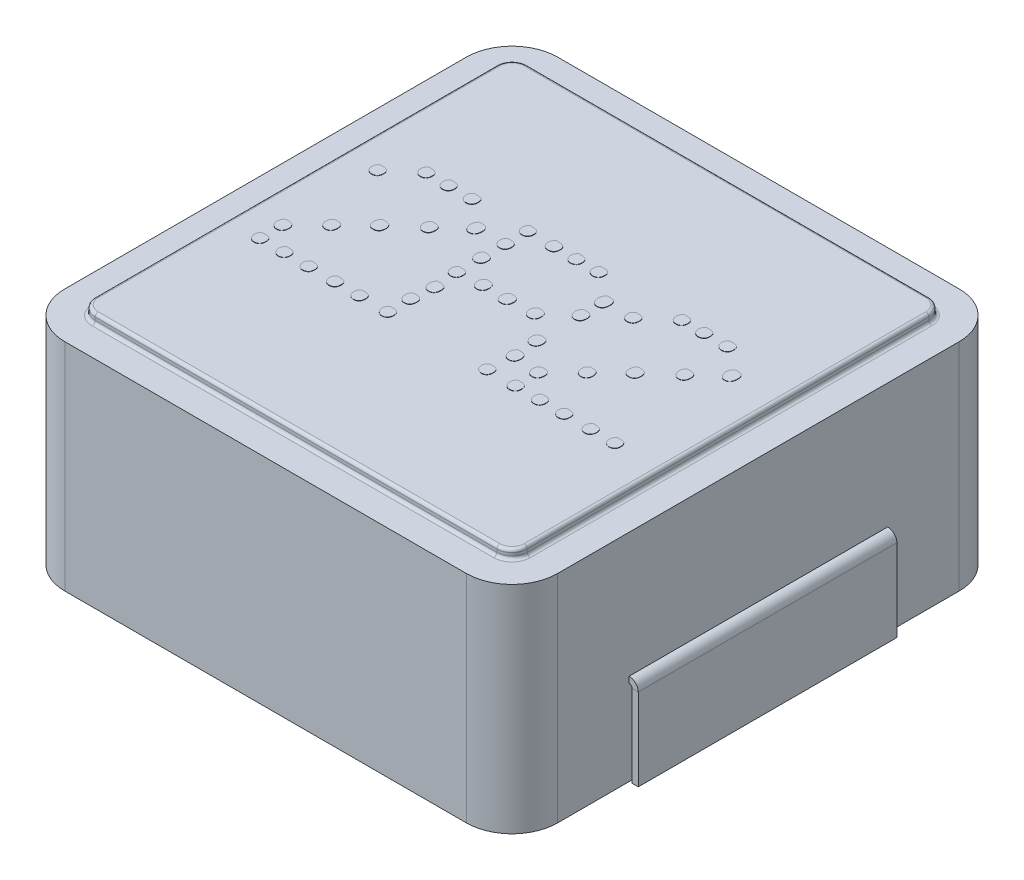
from build123d import *

# Parameters (mm, degrees)
BOSS_EXTRUDE1_DEPTH = 1.8796
SKETCH3_W           = 6.1468
SKETCH3_H           = 6.1468
CUT_EXTRUDE1_DEPTH  = 0.0762
SKETCH4_W           = 2.159
SKETCH4_H           = 0.0508
FILLET1_R           = 0.0254
BOSS_EXTRUDE2_DEPTH = 0.00254


with BuildPart() as part:
    # Sketch1 → Boss-Extrude1 (new body)
    with BuildSketch(Plane(origin=(0, 0, 0), x_dir=(1, 0, 0), z_dir=(0, 1, 0))):
        with BuildLine():
            Line((-1.6764, 2.0574), (1.6764, 2.0574))
            ThreePointArc((1.6764, 2.0574), (1.945807684, 1.945807684), (2.0574, 1.6764))
            Line((2.0574, 1.6764), (2.0574, -1.6764))
            ThreePointArc((2.0574, -1.6764), (1.945807684, -1.945807684), (1.6764, -2.0574))
            Line((1.6764, -2.0574), (-1.6764, -2.0574))
            ThreePointArc((-1.6764, -2.0574), (-1.945807684, -1.945807684), (-2.0574, -1.6764))
            Line((-2.0574, -1.6764), (-2.0574, 1.6764))
            ThreePointArc((-2.0574, 1.6764), (-1.945807684, 1.945807684), (-1.6764, 2.0574))
        make_face()
    extrude(amount=BOSS_EXTRUDE1_DEPTH)

    # Sketch3 → Cut-Extrude1 (cut)
    with BuildSketch(Plane(origin=(0, 1.8796, 0), x_dir=(1, 0, 0), z_dir=(0, 1, 0))):
        Rectangle(SKETCH3_W, SKETCH3_H)
        with BuildLine():
            Line((-1.6764, 1.8034), (1.6764, 1.8034))
            ThreePointArc((1.6764, 1.8034), (1.766202561, 1.766202561), (1.8034, 1.6764))
            Line((1.8034, 1.6764), (1.8034, -1.6764))
            ThreePointArc((1.8034, -1.6764), (1.766202561, -1.766202561), (1.6764, -1.8034))
            Line((1.6764, -1.8034), (-1.6764, -1.8034))
            ThreePointArc((-1.6764, -1.8034), (-1.766202561, -1.766202561), (-1.8034, -1.6764))
            Line((-1.8034, -1.6764), (-1.8034, 1.6764))
            ThreePointArc((-1.8034, 1.6764), (-1.766202561, 1.766202561), (-1.6764, 1.8034))
        make_face(mode=Mode.SUBTRACT)
    extrude(amount=-CUT_EXTRUDE1_DEPTH, mode=Mode.SUBTRACT)

    # Sweep1: sweep along a path in Sketch5
    with BuildLine(Plane.XY) as sweep1_path:
        Line((2.0828, 0), (2.0828, 0.6858))
        ThreePointArc((2.0828, 0.6858), (2.075360512, 0.703760512), (2.0574, 0.7112))
    # Sketch4 → Sweep1 (sweep)
    with BuildSketch(Plane(origin=(2.0574, 0, 0), x_dir=(0, 0, -1), z_dir=(1, 0, 0))):
        with Locations((0, 0.7366)):
            Rectangle(SKETCH4_W, SKETCH4_H)
    sweep1 = sweep(path=sweep1_path.line)

    # Mirror1: Sweep1 across plane
    add(sweep1.mirror(Plane(origin=(0, 0, 0), x_dir=(0, 0, 1), z_dir=(1, 0, 0))))

    # Fillet1
    fillet1_edges = [part.edges().sort_by_distance(p)[0] for p in [
        (0, 1.8034, -1.8034),
        (-1.766202561, 1.8034, -1.766202561),
        (-1.8034, 1.8034, 0),
        (-1.766202561, 1.8034, 1.766202561),
        (0, 1.8034, 1.8034),
        (1.766202561, 1.8034, 1.766202561),
        (1.8034, 1.8034, 0),
        (1.766202561, 1.8034, -1.766202561),
        (-1.766202561, 1.8796, -1.766202561),
        (0, 1.8796, -1.8034),
        (1.766202561, 1.8796, -1.766202561),
        (1.8034, 1.8796, 0),
        (1.766202561, 1.8796, 1.766202561),
        (0, 1.8796, 1.8034),
        (-1.766202561, 1.8796, 1.766202561),
        (-1.8034, 1.8796, 0),
    ]]
    fillet(fillet1_edges, radius=FILLET1_R)

    # Sketch6 → Boss-Extrude2 (add)
    with BuildSketch(Plane(origin=(0, 1.8796, 0), x_dir=(1, 0, 0), z_dir=(0, 1, 0))):
        with BuildLine():
            add(Edge.make_bspline(
                [(-0.651933333, 0.404213362), (-0.65205854, 0.399260874), (-0.652294975, 0.389908778), (-0.654729141, 0.376935675), (-0.658265278, 0.36566911), (-0.663894089, 0.356570696), (-0.671015627, 0.349356739), (-0.679728559, 0.344182786), (-0.690122822, 0.341302801), (-0.697511959, 0.34091694), (-0.701410417, 0.340713362)],
                knots=[0, 0, 0, 0, 1.29324002, 2.442106873, 3.441188442, 4.362743461, 5.210667907, 6.068878158, 6.981153595, 8, 8, 8, 8], degree=3))
            add(Edge.make_bspline(
                [(-0.701410417, 0.340713362), (-0.704887566, 0.340969333), (-0.71189543, 0.34148522), (-0.721818318, 0.345681888), (-0.730838061, 0.352384021), (-0.738904601, 0.361246099), (-0.745243021, 0.371969857), (-0.750201004, 0.383403514), (-0.752819456, 0.395632113), (-0.753291918, 0.40393802), (-0.753533333, 0.408182112)],
                knots=[0, 0, 0, 0, 0.886166991, 1.785985625, 2.705625816, 3.7426079, 4.82489, 5.875497961, 6.91443754, 8, 8, 8, 8], degree=3))
            add(Edge.make_bspline(
                [(-0.753533333, 0.408182112), (-0.753250309, 0.41316575), (-0.752695504, 0.42293506), (-0.747658196, 0.436675507), (-0.73974532, 0.44921407), (-0.732294553, 0.455801546), (-0.728397917, 0.459246695)],
                knots=[0, 0, 0, 0, 1.011898991, 1.983601913, 2.945454831, 4, 4, 4, 4], degree=3))
            Line((-0.728397917, 0.459246695), (-0.70564375, 0.459246695))
            add(Edge.make_bspline(
                [(-0.70564375, 0.459246695), (-0.701389735, 0.459149662), (-0.693402847, 0.458967482), (-0.68232389, 0.456180675), (-0.672751458, 0.452097938), (-0.665156665, 0.445719393), (-0.659105536, 0.437797895), (-0.654986406, 0.428064042), (-0.652218828, 0.416712149), (-0.652032482, 0.408554037), (-0.651933333, 0.404213362)],
                knots=[0, 0, 0, 0, 1.155137991, 2.168764618, 3.093087236, 3.963406134, 4.837693072, 5.783912606, 6.820889322, 8, 8, 8, 8], degree=3))
        make_face()
        with BuildLine():
            add(Edge.make_bspline(
                [(-0.879475, 0.596830028), (-0.879596733, 0.592668903), (-0.879824443, 0.584885233), (-0.882298246, 0.573977454), (-0.886115259, 0.564578782), (-0.891903714, 0.556916262), (-0.899241247, 0.550773217), (-0.908522178, 0.547089365), (-0.91898689, 0.544180177), (-0.926545872, 0.544005598), (-0.930539583, 0.543913362)],
                knots=[0, 0, 0, 0, 1.182839623, 2.212582865, 3.168959802, 4.04800891, 4.922741876, 5.85608629, 6.867285219, 8, 8, 8, 8], degree=3))
            add(Edge.make_bspline(
                [(-0.930539583, 0.543913362), (-0.934086198, 0.544123139), (-0.941148568, 0.544540869), (-0.951400694, 0.547717475), (-0.960479675, 0.553576866), (-0.968685654, 0.56093834), (-0.975441174, 0.569730882), (-0.980269564, 0.57945933), (-0.983339836, 0.589679544), (-0.983769076, 0.596720773), (-0.983985417, 0.600269612)],
                knots=[0, 0, 0, 0, 0.990759098, 1.972897381, 2.957814869, 3.98735933, 5.042256496, 6.034241023, 7.009240902, 8, 8, 8, 8], degree=3))
            add(Edge.make_bspline(
                [(-0.983985417, 0.600269612), (-0.983727071, 0.604739061), (-0.983218137, 0.613543766), (-0.977710557, 0.625740243), (-0.969538099, 0.636857994), (-0.962027039, 0.64252006), (-0.95805625, 0.645513362)],
                knots=[0, 0, 0, 0, 0.981241467, 1.933021278, 2.907273203, 4, 4, 4, 4], degree=3))
            Line((-0.95805625, 0.645513362), (-0.932127083, 0.645513362))
            add(Edge.make_bspline(
                [(-0.932127083, 0.645513362), (-0.92797704, 0.645349779), (-0.920232414, 0.645044507), (-0.909286011, 0.643108767), (-0.900187653, 0.639002617), (-0.89244321, 0.633676308), (-0.886578917, 0.626575516), (-0.88210409, 0.618071331), (-0.879908868, 0.607872957), (-0.879624302, 0.600630117), (-0.879475, 0.596830028)],
                knots=[0, 0, 0, 0, 1.213183958, 2.26398997, 3.221278218, 4.107661874, 4.985015919, 5.883667157, 6.889627383, 8, 8, 8, 8], degree=3))
        make_face()
        with BuildLine():
            add(Edge.make_bspline(
                [(-1.075266667, 0.596036278), (-1.075408481, 0.591971086), (-1.075676428, 0.58429025), (-1.077942037, 0.573422116), (-1.082328239, 0.564362461), (-1.08784991, 0.556496605), (-1.095715766, 0.550974934), (-1.104775421, 0.546588732), (-1.115643555, 0.544323123), (-1.123324391, 0.544055176), (-1.127389583, 0.543913362)],
                knots=[0, 0, 0, 0, 1.154793707, 2.181884409, 3.123215254, 4, 4.876784746, 5.818115591, 6.845206293, 8, 8, 8, 8], degree=3))
            add(Edge.make_bspline(
                [(-1.127389583, 0.543913362), (-1.130506452, 0.544109736), (-1.136730126, 0.544501852), (-1.14574008, 0.547978713), (-1.154290493, 0.553340299), (-1.162018109, 0.560682705), (-1.168698847, 0.569360084), (-1.173488832, 0.579165935), (-1.176165142, 0.589813233), (-1.176629207, 0.597080275), (-1.176866667, 0.600798778)],
                knots=[0, 0, 0, 0, 0.89720237, 1.791508196, 2.752588144, 3.79773078, 4.852141786, 5.90007354, 6.925479952, 8, 8, 8, 8], degree=3))
            add(Edge.make_bspline(
                [(-1.176866667, 0.600798778), (-1.176528596, 0.605152958), (-1.175863454, 0.61371965), (-1.171529199, 0.626023119), (-1.163855571, 0.636919491), (-1.156912779, 0.642582058), (-1.15331875, 0.645513362)],
                knots=[0, 0, 0, 0, 0.995511125, 1.958632443, 2.943258849, 4, 4, 4, 4], degree=3))
            Line((-1.15331875, 0.645513362), (-1.128977083, 0.645513362))
            add(Edge.make_bspline(
                [(-1.128977083, 0.645513362), (-1.124725117, 0.64539764), (-1.116762032, 0.645180917), (-1.105744333, 0.642651594), (-1.096135303, 0.639196663), (-1.088606259, 0.633352041), (-1.082515962, 0.626297106), (-1.078303568, 0.617547502), (-1.075569237, 0.607312282), (-1.075371327, 0.599936698), (-1.075266667, 0.596036278)],
                knots=[0, 0, 0, 0, 1.217569547, 2.280265222, 3.234604943, 4.120687129, 4.982940609, 5.888696038, 6.88348191, 8, 8, 8, 8], degree=3))
        make_face()
        with BuildLine():
            add(Edge.make_bspline(
                [(-0.855133333, 0.213977945), (-0.85526735, 0.209558585), (-0.855518908, 0.20126319), (-0.857827362, 0.18967101), (-0.861913816, 0.179968903), (-0.867139313, 0.171599824), (-0.874615512, 0.16553789), (-0.883342106, 0.160788455), (-0.893801685, 0.158248716), (-0.901247301, 0.158010703), (-0.905139583, 0.157886278)],
                knots=[0, 0, 0, 0, 1.232434161, 2.313350425, 3.272923391, 4.160048912, 5.032726289, 5.924276403, 6.914891414, 8, 8, 8, 8], degree=3))
            add(Edge.make_bspline(
                [(-0.905139583, 0.157886278), (-0.908605085, 0.158073686), (-0.915537215, 0.158448563), (-0.925506732, 0.162002049), (-0.934371162, 0.168112998), (-0.942289133, 0.175941276), (-0.948458932, 0.185529087), (-0.953391914, 0.195780979), (-0.95602228, 0.206973282), (-0.956492722, 0.214583537), (-0.956733333, 0.218475862)],
                knots=[0, 0, 0, 0, 0.941533049, 1.883372337, 2.835867976, 3.854775778, 4.89386193, 5.925427457, 6.938943423, 8, 8, 8, 8], degree=3))
            add(Edge.make_bspline(
                [(-0.956733333, 0.218475862), (-0.956426088, 0.223101217), (-0.95582548, 0.232142947), (-0.95111221, 0.245020356), (-0.94313671, 0.256535011), (-0.935906542, 0.262643277), (-0.932127083, 0.265836278)],
                knots=[0, 0, 0, 0, 1.000545392, 1.955884885, 2.931470478, 4, 4, 4, 4], degree=3))
            Line((-0.932127083, 0.265836278), (-0.906727083, 0.265836278))
            add(Edge.make_bspline(
                [(-0.906727083, 0.265836278), (-0.902657853, 0.265706372), (-0.895055456, 0.265463672), (-0.884320806, 0.263089543), (-0.87531775, 0.258878697), (-0.867736984, 0.253066502), (-0.861907082, 0.245612436), (-0.857845078, 0.236439663), (-0.855524889, 0.225735025), (-0.855268847, 0.218046963), (-0.855133333, 0.213977945)],
                knots=[0, 0, 0, 0, 1.163861949, 2.174401365, 3.123124194, 3.986728766, 4.885774178, 5.80098192, 6.836138051, 8, 8, 8, 8], degree=3))
        make_face()
        with BuildLine():
            add(Edge.make_bspline(
                [(-1.261533333, 0.596830028), (-1.261645456, 0.592664748), (-1.261855188, 0.584873304), (-1.264439871, 0.574049798), (-1.267843631, 0.564510568), (-1.273705597, 0.557009203), (-1.280682856, 0.550847252), (-1.289577787, 0.547024904), (-1.299722134, 0.54419068), (-1.307105749, 0.544009287), (-1.311010417, 0.543913362)],
                knots=[0, 0, 0, 0, 1.201466748, 2.247426182, 3.209100512, 4.101992711, 4.970873069, 5.872469541, 6.874900874, 8, 8, 8, 8], degree=3))
            add(Edge.make_bspline(
                [(-1.311010417, 0.543913362), (-1.314468272, 0.544124227), (-1.32135688, 0.544544304), (-1.331368954, 0.547710602), (-1.340170041, 0.553676094), (-1.348402113, 0.560842308), (-1.354788917, 0.569831671), (-1.359833173, 0.579473681), (-1.362416427, 0.590086819), (-1.362890667, 0.597347906), (-1.363133333, 0.601063362)],
                knots=[0, 0, 0, 0, 0.968334056, 1.92907818, 2.895204665, 3.926982011, 4.969347999, 5.963483951, 6.957926688, 8, 8, 8, 8], degree=3))
            add(Edge.make_bspline(
                [(-1.363133333, 0.601063362), (-1.362781943, 0.605324347), (-1.362083622, 0.613792257), (-1.35787827, 0.625997917), (-1.349954304, 0.636682606), (-1.34315527, 0.642473064), (-1.339585417, 0.645513362)],
                knots=[0, 0, 0, 0, 0.981112336, 1.949776985, 2.923524299, 4, 4, 4, 4], degree=3))
            Line((-1.339585417, 0.645513362), (-1.31524375, 0.645513362))
            add(Edge.make_bspline(
                [(-1.31524375, 0.645513362), (-1.311004774, 0.645350605), (-1.303083908, 0.645046481), (-1.291890919, 0.643094931), (-1.282564878, 0.639074315), (-1.274774256, 0.633668641), (-1.268881387, 0.62658219), (-1.26449665, 0.61803173), (-1.261873568, 0.60791821), (-1.261650188, 0.600638316), (-1.261533333, 0.596830028)],
                knots=[0, 0, 0, 0, 1.226497285, 2.291808478, 3.262905844, 4.140420999, 5.008996888, 5.898656886, 6.900736951, 8, 8, 8, 8], degree=3))
        make_face()
        with BuildLine():
            add(Edge.make_bspline(
                [(-1.075266667, 0.022155028), (-1.075394172, 0.017732619), (-1.075633507, 0.009431499), (-1.078038654, -0.002203515), (-1.081934922, -0.012143225), (-1.08757853, -0.020499572), (-1.095286016, -0.026558515), (-1.104283913, -0.03129678), (-1.114996005, -0.033838054), (-1.122615405, -0.034076602), (-1.126595833, -0.034201222)],
                knots=[0, 0, 0, 0, 1.21336718, 2.277560596, 3.244693305, 4.131760057, 5.009517006, 5.908738174, 6.907510209, 8, 8, 8, 8], degree=3))
            add(Edge.make_bspline(
                [(-1.126595833, -0.034201222), (-1.130581565, -0.033984277), (-1.138033948, -0.033578641), (-1.148545298, -0.030933907), (-1.15756418, -0.026207974), (-1.164476382, -0.018920426), (-1.170236829, -0.010307904), (-1.174161103, 0.000365486), (-1.176480318, 0.012881294), (-1.176732742, 0.021879111), (-1.176866667, 0.026652945)],
                knots=[0, 0, 0, 0, 1.060414838, 1.982727014, 2.865045493, 3.728108773, 4.62651573, 5.607306598, 6.730545238, 8, 8, 8, 8], degree=3))
            add(Edge.make_bspline(
                [(-1.176866667, 0.026652945), (-1.176536495, 0.031271583), (-1.175893159, 0.040270957), (-1.171543179, 0.053170382), (-1.163896277, 0.064604509), (-1.156917812, 0.070637391), (-1.15331875, 0.073748778)],
                knots=[0, 0, 0, 0, 1.015273337, 1.978250884, 2.957306609, 4, 4, 4, 4], degree=3))
            Line((-1.15331875, 0.073748778), (-1.128977083, 0.073748778))
            add(Edge.make_bspline(
                [(-1.128977083, 0.073748778), (-1.124727837, 0.073625165), (-1.116769845, 0.073393662), (-1.105685678, 0.070953879), (-1.096104851, 0.067144248), (-1.088596742, 0.061045042), (-1.082429614, 0.053672277), (-1.078371113, 0.044506208), (-1.075535538, 0.033876441), (-1.075360239, 0.026234315), (-1.075266667, 0.022155028)],
                knots=[0, 0, 0, 0, 1.19294035, 2.234139642, 3.178667807, 4.061931825, 4.925827526, 5.857896947, 6.856567903, 8, 8, 8, 8], degree=3))
        make_face()
        with BuildLine():
            add(Edge.make_bspline(
                [(-1.481666667, 0.411357112), (-1.4817945, 0.407111156), (-1.482033905, 0.399159327), (-1.48442176, 0.388034665), (-1.488360723, 0.378684883), (-1.493788814, 0.370796872), (-1.501154367, 0.364998869), (-1.509950156, 0.360609478), (-1.520324827, 0.35798866), (-1.527777136, 0.357764091), (-1.531672917, 0.357646695)],
                knots=[0, 0, 0, 0, 1.211705509, 2.269283046, 3.228668804, 4.09560097, 4.973085899, 5.874479044, 6.888859267, 8, 8, 8, 8], degree=3))
            add(Edge.make_bspline(
                [(-1.531672917, 0.357646695), (-1.535131362, 0.357856785), (-1.542021145, 0.358275319), (-1.552024445, 0.361453147), (-1.560805425, 0.367337249), (-1.568822466, 0.374593293), (-1.57489798, 0.383641693), (-1.579979189, 0.393198939), (-1.582546412, 0.403822285), (-1.583022867, 0.411081961), (-1.583266667, 0.414796695)],
                knots=[0, 0, 0, 0, 0.972300248, 1.936979476, 2.907063111, 3.924797633, 4.956934776, 5.955142601, 6.953658468, 8, 8, 8, 8], degree=3))
            add(Edge.make_bspline(
                [(-1.583266667, 0.414796695), (-1.582967028, 0.41933661), (-1.5823867, 0.428129318), (-1.577677731, 0.440515151), (-1.569731082, 0.451279686), (-1.562447303, 0.456521461), (-1.558660417, 0.459246695)],
                knots=[0, 0, 0, 0, 1.023518865, 1.982306587, 2.95098748, 4, 4, 4, 4], degree=3))
            Line((-1.558660417, 0.459246695), (-1.5351125, 0.459246695))
            add(Edge.make_bspline(
                [(-1.5351125, 0.459246695), (-1.530959107, 0.459087042), (-1.52312171, 0.458785778), (-1.512085445, 0.456760396), (-1.502602374, 0.453050372), (-1.494692963, 0.447731884), (-1.488699776, 0.440645059), (-1.484756028, 0.43202359), (-1.481971545, 0.422200876), (-1.481771427, 0.415083182), (-1.481666667, 0.411357112)],
                knots=[0, 0, 0, 0, 1.212537751, 2.288042205, 3.258577953, 4.165563546, 5.042450265, 5.929109705, 6.915901195, 8, 8, 8, 8], degree=3))
        make_face()
        with BuildLine():
            add(Edge.make_bspline(
                [(-0.651933333, -0.570247055), (-0.652060101, -0.574495844), (-0.652300086, -0.582539317), (-0.654734686, -0.593678042), (-0.658332873, -0.60338021), (-0.663999572, -0.611129635), (-0.671160883, -0.617229239), (-0.679895793, -0.621452177), (-0.690135423, -0.624183343), (-0.697510346, -0.624381727), (-0.701410417, -0.624486638)],
                knots=[0, 0, 0, 0, 1.210740665, 2.292078747, 3.241065941, 4.142444712, 4.999862142, 5.900537535, 6.889744034, 8, 8, 8, 8], degree=3))
            add(Edge.make_bspline(
                [(-0.701410417, -0.624486638), (-0.704789562, -0.624195041), (-0.711739117, -0.623595342), (-0.721725932, -0.619818369), (-0.73064123, -0.61382656), (-0.738705817, -0.606780033), (-0.745148475, -0.598113084), (-0.749874332, -0.588330256), (-0.752829205, -0.577820701), (-0.753301099, -0.570617151), (-0.753533333, -0.567072055)],
                knots=[0, 0, 0, 0, 0.950722975, 1.955257841, 2.959792706, 3.960953037, 4.953161855, 5.973799471, 7.002842479, 8, 8, 8, 8], degree=3))
            add(Edge.make_bspline(
                [(-0.753533333, -0.567072055), (-0.75319178, -0.562719971), (-0.752519787, -0.554157401), (-0.74825995, -0.541892501), (-0.740494331, -0.531207866), (-0.733574623, -0.525728664), (-0.729985417, -0.522886638)],
                knots=[0, 0, 0, 0, 1.00298653, 1.973340035, 2.948785067, 4, 4, 4, 4], degree=3))
            Line((-0.729985417, -0.522886638), (-0.70485, -0.522886638))
            add(Edge.make_bspline(
                [(-0.70485, -0.522886638), (-0.700697017, -0.523048842), (-0.692860393, -0.523354918), (-0.68189983, -0.525333762), (-0.67257144, -0.529067505), (-0.665011567, -0.534477754), (-0.658943829, -0.541302908), (-0.65468568, -0.549666696), (-0.652317622, -0.559535769), (-0.652066708, -0.566529507), (-0.651933333, -0.570247055)],
                knots=[0, 0, 0, 0, 1.225452536, 2.312412229, 3.269174563, 4.16452196, 5.031047758, 5.938786797, 6.904354418, 8, 8, 8, 8], degree=3))
        make_face()
        with BuildLine():
            add(Edge.make_bspline(
                [(-0.855133333, -0.571040805), (-0.855266205, -0.57519884), (-0.855517505, -0.583062916), (-0.857893874, -0.594091399), (-0.861809775, -0.603471922), (-0.867347549, -0.611303987), (-0.874455845, -0.617482662), (-0.883510408, -0.621430339), (-0.893775115, -0.624174837), (-0.90123818, -0.624379597), (-0.905139583, -0.624486638)],
                knots=[0, 0, 0, 0, 1.189534525, 2.249762435, 3.21155249, 4.080657256, 4.976509945, 5.86915232, 6.88607466, 8, 8, 8, 8], degree=3))
            add(Edge.make_bspline(
                [(-0.905139583, -0.624486638), (-0.908512609, -0.624279992), (-0.915235479, -0.62386812), (-0.925020983, -0.620608679), (-0.933762874, -0.614814584), (-0.941725862, -0.607454219), (-0.948160261, -0.598587567), (-0.953088085, -0.588878475), (-0.956050329, -0.578530779), (-0.956506272, -0.571411327), (-0.956733333, -0.567865805)],
                knots=[0, 0, 0, 0, 0.956799623, 1.907023225, 2.886491296, 3.91407122, 4.970831612, 5.978695942, 6.993380717, 8, 8, 8, 8], degree=3))
            add(Edge.make_bspline(
                [(-0.956733333, -0.567865805), (-0.956535584, -0.563410088), (-0.956144841, -0.554605822), (-0.951375857, -0.542438368), (-0.94425017, -0.53137726), (-0.937512025, -0.525807109), (-0.933979167, -0.522886638)],
                knots=[0, 0, 0, 0, 1.016038456, 2.007639546, 2.955391052, 4, 4, 4, 4], degree=3))
            Line((-0.933979167, -0.522886638), (-0.908579167, -0.522886638))
            add(Edge.make_bspline(
                [(-0.908579167, -0.522886638), (-0.904431137, -0.523057799), (-0.896603862, -0.523380778), (-0.885466834, -0.525267704), (-0.876222244, -0.529456273), (-0.868073873, -0.534353249), (-0.862180847, -0.541511442), (-0.858218143, -0.550102683), (-0.855416374, -0.560020276), (-0.855231299, -0.567226386), (-0.855133333, -0.571040805)],
                knots=[0, 0, 0, 0, 1.209337477, 2.282003332, 3.259804929, 4.150069263, 5.024641598, 5.908960861, 6.893147894, 8, 8, 8, 8], degree=3))
        make_face()
        with BuildLine():
            add(Edge.make_bspline(
                [(-1.278466667, -0.177076222), (-1.278596074, -0.181497522), (-1.278838978, -0.18979656), (-1.281220576, -0.201445308), (-1.285175377, -0.211293698), (-1.290484195, -0.219706236), (-1.297990186, -0.2258688), (-1.306816488, -0.230406992), (-1.317291869, -0.233139192), (-1.324751227, -0.233330328), (-1.3287375, -0.233432472)],
                knots=[0, 0, 0, 0, 1.225495791, 2.300326702, 3.277126704, 4.159257877, 5.027022246, 5.935231875, 6.896589868, 8, 8, 8, 8], degree=3))
            add(Edge.make_bspline(
                [(-1.3287375, -0.233432472), (-1.332117752, -0.233248277), (-1.33888404, -0.232879573), (-1.348632087, -0.229242406), (-1.357459042, -0.223224112), (-1.365324392, -0.215294163), (-1.37183913, -0.205879605), (-1.376655326, -0.195600397), (-1.379368886, -0.184619554), (-1.37983051, -0.17717865), (-1.380066667, -0.173372055)],
                knots=[0, 0, 0, 0, 0.92694184, 1.855469552, 2.817614311, 3.846844012, 4.910104658, 5.952120311, 6.952351789, 8, 8, 8, 8], degree=3))
            add(Edge.make_bspline(
                [(-1.380066667, -0.173372055), (-1.379787779, -0.168647789), (-1.37924085, -0.159382999), (-1.374103268, -0.146386694), (-1.366309667, -0.134448607), (-1.358833699, -0.128383742), (-1.35493125, -0.125217888)],
                knots=[0, 0, 0, 0, 1.0011599, 1.963381256, 2.936886848, 4, 4, 4, 4], degree=3))
            Line((-1.35493125, -0.125217888), (-1.330589583, -0.125217888))
            add(Edge.make_bspline(
                [(-1.330589583, -0.125217888), (-1.326524463, -0.125359737), (-1.318843764, -0.125627749), (-1.307974717, -0.127892923), (-1.298918099, -0.132280576), (-1.291041837, -0.137797273), (-1.285605374, -0.145615741), (-1.28107814, -0.154518545), (-1.278890658, -0.165336837), (-1.278613406, -0.173013328), (-1.278466667, -0.177076222)],
                knots=[0, 0, 0, 0, 1.158065921, 2.188066979, 3.132065172, 4.011334368, 4.890603564, 5.811933021, 6.841934079, 8, 8, 8, 8], degree=3))
        make_face()
        with BuildLine():
            add(Edge.make_bspline(
                [(-1.075266667, -0.570776222), (-1.075382388, -0.575028187), (-1.075599111, -0.582991273), (-1.078128435, -0.594008972), (-1.081583365, -0.603618002), (-1.087427987, -0.611147046), (-1.094482923, -0.617237343), (-1.103232527, -0.621449737), (-1.113467747, -0.624184068), (-1.12084333, -0.624381978), (-1.12474375, -0.624486638)],
                knots=[0, 0, 0, 0, 1.217569547, 2.280265222, 3.234604943, 4.120687129, 4.982940609, 5.888696038, 6.88348191, 8, 8, 8, 8], degree=3))
            add(Edge.make_bspline(
                [(-1.12474375, -0.624486638), (-1.128201606, -0.624275773), (-1.135090214, -0.623855696), (-1.145102288, -0.620689398), (-1.153903374, -0.614723906), (-1.162135446, -0.607557692), (-1.168522251, -0.598568329), (-1.173566506, -0.588926319), (-1.176149761, -0.578313181), (-1.176624001, -0.571052094), (-1.176866667, -0.567336638)],
                knots=[0, 0, 0, 0, 0.968334056, 1.92907818, 2.895204665, 3.926982011, 4.969347999, 5.963483951, 6.957926688, 8, 8, 8, 8], degree=3))
            add(Edge.make_bspline(
                [(-1.176866667, -0.567336638), (-1.176584166, -0.562876269), (-1.17602978, -0.554123129), (-1.170951452, -0.54193826), (-1.163002805, -0.531022196), (-1.15561881, -0.525692592), (-1.15173125, -0.522886638)],
                knots=[0, 0, 0, 0, 0.999862111, 1.962154378, 2.927105762, 4, 4, 4, 4], degree=3))
            Line((-1.15173125, -0.522886638), (-1.128183333, -0.522886638))
            add(Edge.make_bspline(
                [(-1.128183333, -0.522886638), (-1.124030788, -0.52304921), (-1.116194992, -0.523355979), (-1.105228979, -0.525330251), (-1.095918063, -0.529078659), (-1.08824403, -0.53447828), (-1.082365105, -0.541554065), (-1.077949522, -0.549991633), (-1.075688247, -0.559990006), (-1.075411822, -0.567062389), (-1.075266667, -0.570776222)],
                knots=[0, 0, 0, 0, 1.21860332, 2.299487851, 3.250902714, 4.141245896, 5.022519131, 5.925184696, 6.910478126, 8, 8, 8, 8], degree=3))
        make_face()
        with BuildLine():
            add(Edge.make_bspline(
                [(-1.278466667, -0.570776222), (-1.278594459, -0.575022267), (-1.278833788, -0.582974263), (-1.281222145, -0.594097828), (-1.285159473, -0.603451178), (-1.29059302, -0.61132729), (-1.298000964, -0.617219599), (-1.306886912, -0.621403615), (-1.31728225, -0.624213759), (-1.324747876, -0.6243916), (-1.3287375, -0.624486638)],
                knots=[0, 0, 0, 0, 1.208178271, 2.262677232, 3.219270246, 4.083678799, 4.958609397, 5.879916344, 6.8670293, 8, 8, 8, 8], degree=3))
            add(Edge.make_bspline(
                [(-1.3287375, -0.624486638), (-1.332110491, -0.624279983), (-1.338833291, -0.623868092), (-1.348619318, -0.620608793), (-1.357359132, -0.614814131), (-1.365330383, -0.607456025), (-1.371733288, -0.598580761), (-1.376763625, -0.588923074), (-1.379350521, -0.578314038), (-1.379824258, -0.571052384), (-1.380066667, -0.567336638)],
                knots=[0, 0, 0, 0, 0.951644686, 1.896748782, 2.870939786, 3.892983432, 4.94405033, 5.946484603, 6.949228221, 8, 8, 8, 8], degree=3))
            add(Edge.make_bspline(
                [(-1.380066667, -0.567336638), (-1.379849042, -0.562890204), (-1.379424576, -0.554217631), (-1.375011973, -0.5419695), (-1.367614967, -0.531294343), (-1.360986719, -0.52574254), (-1.357577083, -0.522886638)],
                knots=[0, 0, 0, 0, 1.027107677, 2.003328185, 2.972892323, 4, 4, 4, 4], degree=3))
            Line((-1.357577083, -0.522886638), (-1.332177083, -0.522886638))
            add(Edge.make_bspline(
                [(-1.332177083, -0.522886638), (-1.327934104, -0.5230398), (-1.320005758, -0.523325994), (-1.308895151, -0.525388924), (-1.299438639, -0.529005246), (-1.29171659, -0.534486158), (-1.285808641, -0.541547046), (-1.281485386, -0.550032748), (-1.27879515, -0.559943685), (-1.278579538, -0.567054009), (-1.278466667, -0.570776222)],
                knots=[0, 0, 0, 0, 1.235740628, 2.309080407, 3.277662751, 4.16179119, 5.036912992, 5.933277802, 6.918083169, 8, 8, 8, 8], degree=3))
        make_face()
        with BuildLine():
            add(Edge.make_bspline(
                [(-1.481666667, -0.379747055), (-1.481773199, -0.384265249), (-1.48197134, -0.39266873), (-1.484593232, -0.404353608), (-1.487898833, -0.414622087), (-1.493833535, -0.422689846), (-1.500696026, -0.429441496), (-1.509698344, -0.43349955), (-1.519811326, -0.436696062), (-1.527231985, -0.436827675), (-1.53114375, -0.436897055)],
                knots=[0, 0, 0, 0, 1.25001827, 2.324934849, 3.315807932, 4.211813062, 5.077574566, 5.95296358, 6.920914368, 8, 8, 8, 8], degree=3))
            add(Edge.make_bspline(
                [(-1.53114375, -0.436897055), (-1.534608629, -0.436708894), (-1.541539514, -0.436332511), (-1.551518409, -0.432790369), (-1.560397847, -0.426598642), (-1.568537099, -0.418860841), (-1.57502196, -0.409329942), (-1.579911969, -0.398994387), (-1.582559089, -0.387812137), (-1.583027232, -0.380200503), (-1.583266667, -0.376307472)],
                knots=[0, 0, 0, 0, 0.937941636, 1.876188344, 2.825050755, 3.857127679, 4.905710078, 5.93334077, 6.94299075, 8, 8, 8, 8], degree=3))
            add(Edge.make_bspline(
                [(-1.583266667, -0.376307472), (-1.582933549, -0.37160235), (-1.582284439, -0.362433993), (-1.57800229, -0.349334388), (-1.570360797, -0.337840958), (-1.563324932, -0.331960858), (-1.55971875, -0.328947055)],
                knots=[0, 0, 0, 0, 1.028271719, 2.003680674, 2.976800829, 4, 4, 4, 4], degree=3))
            Line((-1.55971875, -0.328947055), (-1.536435417, -0.328947055))
            add(Edge.make_bspline(
                [(-1.536435417, -0.328947055), (-1.532101756, -0.329077845), (-1.523976303, -0.32932307), (-1.512670264, -0.331664544), (-1.50309137, -0.335664545), (-1.495201353, -0.341349641), (-1.488900684, -0.348641546), (-1.484715328, -0.357721736), (-1.481967772, -0.36820904), (-1.481770757, -0.375758419), (-1.481666667, -0.379747055)],
                knots=[0, 0, 0, 0, 1.214266295, 2.276704316, 3.218570968, 4.104195079, 4.981490252, 5.888614051, 6.884470927, 8, 8, 8, 8], degree=3))
        make_face()
        with BuildLine():
            add(Edge.make_bspline(
                [(-1.481666667, -0.570776222), (-1.4817945, -0.575022177), (-1.482033905, -0.582974007), (-1.48442176, -0.594098669), (-1.488360723, -0.60344845), (-1.493788814, -0.611336462), (-1.501154367, -0.617134464), (-1.509950156, -0.621523855), (-1.520324827, -0.624144674), (-1.527777136, -0.624369242), (-1.531672917, -0.624486638)],
                knots=[0, 0, 0, 0, 1.211705509, 2.269283046, 3.228668804, 4.09560097, 4.973085899, 5.874479044, 6.888859267, 8, 8, 8, 8], degree=3))
            add(Edge.make_bspline(
                [(-1.531672917, -0.624486638), (-1.53514206, -0.624304646), (-1.542081476, -0.623940602), (-1.551950303, -0.620322345), (-1.560997157, -0.614572319), (-1.568722006, -0.60670311), (-1.575006399, -0.597397901), (-1.579862571, -0.587463112), (-1.58256689, -0.576733785), (-1.583029799, -0.569467337), (-1.583266667, -0.565749138)],
                knots=[0, 0, 0, 0, 0.959424122, 1.919160302, 2.876397165, 3.91466632, 4.953223843, 5.982222552, 6.96751512, 8, 8, 8, 8], degree=3))
            add(Edge.make_bspline(
                [(-1.583266667, -0.565749138), (-1.582943596, -0.561480265), (-1.582305494, -0.553048738), (-1.577754637, -0.541089195), (-1.569536281, -0.530833383), (-1.562419509, -0.525633321), (-1.558660417, -0.522886638)],
                knots=[0, 0, 0, 0, 0.991337993, 1.958009304, 2.921416663, 4, 4, 4, 4], degree=3))
            Line((-1.558660417, -0.522886638), (-1.5351125, -0.522886638))
            add(Edge.make_bspline(
                [(-1.5351125, -0.522886638), (-1.530959107, -0.523046292), (-1.52312171, -0.523347556), (-1.512085445, -0.525372937), (-1.502602374, -0.529082962), (-1.494692963, -0.534401449), (-1.488699776, -0.541488274), (-1.484756028, -0.550109744), (-1.481971545, -0.559932457), (-1.481771427, -0.567050151), (-1.481666667, -0.570776222)],
                knots=[0, 0, 0, 0, 1.212537751, 2.288042205, 3.258577953, 4.165563546, 5.042450265, 5.929109705, 6.915901195, 8, 8, 8, 8], degree=3))
        make_face()
        with BuildLine():
            add(Edge.make_bspline(
                [(0.414866667, 0.404213362), (0.41474146, 0.399260874), (0.414505025, 0.389908778), (0.412070859, 0.376935675), (0.408534722, 0.36566911), (0.402905911, 0.356570696), (0.395784373, 0.349356739), (0.387071441, 0.344182786), (0.376677178, 0.341302801), (0.369288041, 0.34091694), (0.365389583, 0.340713362)],
                knots=[0, 0, 0, 0, 1.29324002, 2.442106873, 3.441188442, 4.362743461, 5.210667907, 6.068878158, 6.981153595, 8, 8, 8, 8], degree=3))
            add(Edge.make_bspline(
                [(0.365389583, 0.340713362), (0.361912434, 0.340969333), (0.35490457, 0.34148522), (0.344981682, 0.345681888), (0.335961939, 0.352384021), (0.327895399, 0.361246099), (0.321556979, 0.371969857), (0.316598996, 0.383403514), (0.313980544, 0.395632113), (0.313508082, 0.40393802), (0.313266667, 0.408182112)],
                knots=[0, 0, 0, 0, 0.886166991, 1.785985625, 2.705625816, 3.7426079, 4.82489, 5.875497961, 6.91443754, 8, 8, 8, 8], degree=3))
            add(Edge.make_bspline(
                [(0.313266667, 0.408182112), (0.313549691, 0.41316575), (0.314104496, 0.42293506), (0.319141804, 0.436675507), (0.32705468, 0.44921407), (0.334505447, 0.455801546), (0.338402083, 0.459246695)],
                knots=[0, 0, 0, 0, 1.011898991, 1.983601913, 2.945454831, 4, 4, 4, 4], degree=3))
            Line((0.338402083, 0.459246695), (0.36115625, 0.459246695))
            add(Edge.make_bspline(
                [(0.36115625, 0.459246695), (0.365410265, 0.459149662), (0.373397153, 0.458967482), (0.38447611, 0.456180675), (0.394048542, 0.452097938), (0.401643335, 0.445719393), (0.407694464, 0.437797895), (0.411813594, 0.428064042), (0.414581172, 0.416712149), (0.414767518, 0.408554037), (0.414866667, 0.404213362)],
                knots=[0, 0, 0, 0, 1.155137991, 2.168764618, 3.093087236, 3.963406134, 4.837693072, 5.783912606, 6.820889322, 8, 8, 8, 8], degree=3))
        make_face()
        with BuildLine():
            add(Edge.make_bspline(
                [(0.1778, 0.596830028), (0.177687878, 0.592664748), (0.177478145, 0.584873304), (0.174893462, 0.574049798), (0.171489702, 0.564510568), (0.165627737, 0.557009203), (0.158650477, 0.550847252), (0.149755546, 0.547024904), (0.139611199, 0.54419068), (0.132227584, 0.544009287), (0.128322917, 0.543913362)],
                knots=[0, 0, 0, 0, 1.201466748, 2.247426182, 3.209100512, 4.101992711, 4.970873069, 5.872469541, 6.874900874, 8, 8, 8, 8], degree=3))
            add(Edge.make_bspline(
                [(0.128322917, 0.543913362), (0.124865054, 0.544124225), (0.117976433, 0.544544299), (0.107964458, 0.547710621), (0.099162987, 0.55367602), (0.090932454, 0.560842609), (0.084539862, 0.56983056), (0.079555901, 0.579401524), (0.076931486, 0.58972917), (0.076445674, 0.596729544), (0.0762, 0.600269612)],
                knots=[0, 0, 0, 0, 0.9772603, 1.946860702, 2.921893082, 3.963181502, 5.015156171, 6.018456213, 6.997939366, 8, 8, 8, 8], degree=3))
            add(Edge.make_bspline(
                [(0.0762, 0.600269612), (0.07647974, 0.604731313), (0.077028709, 0.613487068), (0.082174512, 0.625719392), (0.090097393, 0.636849499), (0.097451058, 0.642518747), (0.101335417, 0.645513362)],
                knots=[0, 0, 0, 0, 0.989613861, 1.942042955, 2.912944148, 4, 4, 4, 4], degree=3))
            Line((0.101335417, 0.645513362), (0.126470833, 0.645513362))
            add(Edge.make_bspline(
                [(0.126470833, 0.645513362), (0.130441567, 0.645335471), (0.138003769, 0.64499668), (0.148726759, 0.643173487), (0.157658859, 0.638915776), (0.165358614, 0.633757081), (0.170981069, 0.626546131), (0.175112086, 0.618004631), (0.17738595, 0.607881135), (0.177657517, 0.600632931), (0.1778, 0.596830028)],
                knots=[0, 0, 0, 0, 1.176904575, 2.241396662, 3.187336377, 4.085264612, 4.957416977, 5.856103278, 6.875165491, 8, 8, 8, 8], degree=3))
        make_face()
        with BuildLine():
            add(Edge.make_bspline(
                [(0.414866667, 0.211596695), (0.414760135, 0.207078501), (0.414561994, 0.19867502), (0.411940101, 0.186990142), (0.4086345, 0.176721663), (0.402699799, 0.168653904), (0.395837308, 0.161902254), (0.38683499, 0.1578442), (0.376722007, 0.154647688), (0.369301349, 0.154516075), (0.365389583, 0.154446695)],
                knots=[0, 0, 0, 0, 1.25001827, 2.324934849, 3.315807932, 4.211813062, 5.077574566, 5.95296358, 6.920914368, 8, 8, 8, 8], degree=3))
            add(Edge.make_bspline(
                [(0.365389583, 0.154446695), (0.361924704, 0.154634856), (0.35499382, 0.155011239), (0.345014924, 0.158553381), (0.336135486, 0.164745108), (0.327996234, 0.172482909), (0.321511374, 0.182013808), (0.316621365, 0.192349363), (0.313974244, 0.203531613), (0.313506102, 0.211143247), (0.313266667, 0.215036278)],
                knots=[0, 0, 0, 0, 0.937941636, 1.876188344, 2.825050755, 3.857127679, 4.905710078, 5.93334077, 6.94299075, 8, 8, 8, 8], degree=3))
            add(Edge.make_bspline(
                [(0.313266667, 0.215036278), (0.313548179, 0.219759471), (0.314100254, 0.229022156), (0.319173318, 0.241965147), (0.326986245, 0.253694273), (0.334496112, 0.259419129), (0.338402083, 0.262396695)],
                knots=[0, 0, 0, 0, 1.011353552, 1.983372094, 2.951127782, 4, 4, 4, 4], degree=3))
            Line((0.338402083, 0.262396695), (0.36115625, 0.262396695))
            add(Edge.make_bspline(
                [(0.36115625, 0.262396695), (0.365403867, 0.262271044), (0.373358808, 0.262035726), (0.384463024, 0.259621015), (0.39392788, 0.255749497), (0.401626882, 0.249981471), (0.40760943, 0.242615444), (0.411832181, 0.233632572), (0.414561363, 0.223131582), (0.414761125, 0.21558425), (0.414866667, 0.211596695)],
                knots=[0, 0, 0, 0, 1.202294003, 2.251657171, 3.203591231, 4.07855669, 4.949226057, 5.866045906, 6.872547279, 8, 8, 8, 8], degree=3))
        make_face()
        with BuildLine():
            add(Edge.make_bspline(
                [(-0.008466667, 0.596036278), (-0.008608481, 0.591971086), (-0.008876428, 0.58429025), (-0.011142037, 0.573422116), (-0.015528239, 0.564362461), (-0.02104991, 0.556496605), (-0.028915766, 0.550974934), (-0.037975421, 0.546588732), (-0.048843555, 0.544323123), (-0.056524391, 0.544055176), (-0.060589583, 0.543913362)],
                knots=[0, 0, 0, 0, 1.154793707, 2.181884409, 3.123215254, 4, 4.876784746, 5.818115591, 6.845206293, 8, 8, 8, 8], degree=3))
            add(Edge.make_bspline(
                [(-0.060589583, 0.543913362), (-0.063706452, 0.544109736), (-0.069930126, 0.544501852), (-0.07894008, 0.547978713), (-0.087490493, 0.553340299), (-0.095218109, 0.560682705), (-0.101898847, 0.569360084), (-0.106688832, 0.579165935), (-0.109365142, 0.589813233), (-0.109829207, 0.597080275), (-0.110066667, 0.600798778)],
                knots=[0, 0, 0, 0, 0.89720237, 1.791508196, 2.752588144, 3.79773078, 4.852141786, 5.90007354, 6.925479952, 8, 8, 8, 8], degree=3))
            add(Edge.make_bspline(
                [(-0.110066667, 0.600798778), (-0.109728596, 0.605152958), (-0.109063454, 0.61371965), (-0.104729199, 0.626023119), (-0.097055571, 0.636919491), (-0.090112779, 0.642582058), (-0.08651875, 0.645513362)],
                knots=[0, 0, 0, 0, 0.995511125, 1.958632443, 2.943258849, 4, 4, 4, 4], degree=3))
            Line((-0.08651875, 0.645513362), (-0.062177083, 0.645513362))
            add(Edge.make_bspline(
                [(-0.062177083, 0.645513362), (-0.057925117, 0.64539764), (-0.049962032, 0.645180917), (-0.038944333, 0.642651594), (-0.029335303, 0.639196663), (-0.021806259, 0.633352041), (-0.015715962, 0.626297106), (-0.011503568, 0.617547502), (-0.008769237, 0.607312282), (-0.008571327, 0.599936698), (-0.008466667, 0.596036278)],
                knots=[0, 0, 0, 0, 1.217569547, 2.280265222, 3.234604943, 4.120687129, 4.982940609, 5.888696038, 6.88348191, 8, 8, 8, 8], degree=3))
        make_face()
        with BuildLine():
            add(Edge.make_bspline(
                [(-0.194997917, 0.596830028), (-0.195119679, 0.592668971), (-0.195347442, 0.584885427), (-0.19782089, 0.573976813), (-0.20163909, 0.564580927), (-0.207423523, 0.556908967), (-0.214713341, 0.550853248), (-0.223839043, 0.547024088), (-0.234251001, 0.544193152), (-0.241806203, 0.544010084), (-0.245797917, 0.543913362)],
                knots=[0, 0, 0, 0, 1.186238545, 2.218940781, 3.178065893, 4.059640972, 4.936887507, 5.849925697, 6.864030333, 8, 8, 8, 8], degree=3))
            add(Edge.make_bspline(
                [(-0.245797917, 0.543913362), (-0.249439507, 0.544100079), (-0.256519601, 0.544463101), (-0.266769313, 0.547853961), (-0.275972355, 0.553479277), (-0.284202709, 0.560951059), (-0.290960347, 0.569729167), (-0.29584943, 0.57953088), (-0.298880811, 0.590037131), (-0.299296365, 0.597338855), (-0.299508333, 0.601063362)],
                knots=[0, 0, 0, 0, 1.003387846, 1.950818385, 2.944999281, 3.962478694, 5.005013708, 5.985373346, 6.972367298, 8, 8, 8, 8], degree=3))
            add(Edge.make_bspline(
                [(-0.299508333, 0.601063362), (-0.299183401, 0.60533455), (-0.298535347, 0.613853132), (-0.293914801, 0.625934308), (-0.286075717, 0.636773277), (-0.279111723, 0.642491356), (-0.27543125, 0.645513362)],
                knots=[0, 0, 0, 0, 0.975752571, 1.946069152, 2.914496935, 4, 4, 4, 4], degree=3))
            Line((-0.27543125, 0.645513362), (-0.250295833, 0.645513362))
            add(Edge.make_bspline(
                [(-0.250295833, 0.645513362), (-0.245969835, 0.645348415), (-0.237876227, 0.645039814), (-0.226412791, 0.643109602), (-0.21680246, 0.638994022), (-0.208560358, 0.63376749), (-0.202333606, 0.626660303), (-0.197973063, 0.61802369), (-0.195334697, 0.607920558), (-0.195113585, 0.600639122), (-0.194997917, 0.596830028)],
                knots=[0, 0, 0, 0, 1.231529823, 2.304097012, 3.282462262, 4.186961256, 5.057784344, 5.93293274, 6.918667474, 8, 8, 8, 8], degree=3))
        make_face()
        with BuildLine():
            add(Edge.make_bspline(
                [(0.414866667, -0.154851222), (0.414733755, -0.159448129), (0.41448374, -0.168095176), (0.41214897, -0.180185365), (0.408172371, -0.190400904), (0.402770053, -0.199020558), (0.395537961, -0.205825568), (0.386448821, -0.210198777), (0.376098972, -0.213399449), (0.368593913, -0.213522937), (0.364595833, -0.213588722)],
                knots=[0, 0, 0, 0, 1.246457094, 2.34465755, 3.322301248, 4.205140226, 5.085705934, 5.974041491, 6.920735453, 8, 8, 8, 8], degree=3))
            add(Edge.make_bspline(
                [(0.364595833, -0.213588722), (0.361221033, -0.213289533), (0.354476031, -0.212691564), (0.344617079, -0.209188315), (0.335884463, -0.202799776), (0.327906712, -0.194624678), (0.321570574, -0.184736835), (0.316608418, -0.174095733), (0.313999657, -0.162733347), (0.313512868, -0.15503873), (0.313266667, -0.151147055)],
                knots=[0, 0, 0, 0, 0.910739627, 1.820238464, 2.776050718, 3.801127796, 4.881973202, 5.924256718, 6.950159694, 8, 8, 8, 8], degree=3))
            add(Edge.make_bspline(
                [(0.313266667, -0.151147055), (0.313588564, -0.146439007), (0.31421009, -0.137348596), (0.318590611, -0.124365014), (0.326236933, -0.112930913), (0.33321548, -0.106898028), (0.336814583, -0.103786638)],
                knots=[0, 0, 0, 0, 1.029583578, 1.987944139, 2.962305792, 4, 4, 4, 4], degree=3))
            Line((0.336814583, -0.103786638), (0.36115625, -0.103786638))
            add(Edge.make_bspline(
                [(0.36115625, -0.103786638), (0.365403941, -0.103912255), (0.373359021, -0.104147509), (0.384462327, -0.106562641), (0.393930156, -0.110432782), (0.401619137, -0.116205449), (0.407689912, -0.1236165), (0.411766071, -0.132759401), (0.414574838, -0.143309967), (0.414765783, -0.150861465), (0.414866667, -0.154851222)],
                knots=[0, 0, 0, 0, 1.1989134, 2.245325975, 3.194583392, 4.067088629, 4.935309853, 5.872046145, 6.875717444, 8, 8, 8, 8], degree=3))
        make_face()
        with BuildLine():
            add(Edge.make_bspline(
                [(0.211666667, 0.033796695), (0.211547671, 0.02928428), (0.211326349, 0.020891545), (0.208849368, 0.009105551), (0.205045469, -0.000912844), (0.199552185, -0.009334391), (0.192361692, -0.015798721), (0.183318777, -0.020029648), (0.173063097, -0.02311138), (0.165567033, -0.02327042), (0.161660417, -0.023353305)],
                knots=[0, 0, 0, 0, 1.24432859, 2.314352495, 3.309398119, 4.187584105, 5.067457288, 5.938861813, 6.925826019, 8, 8, 8, 8], degree=3))
            add(Edge.make_bspline(
                [(0.161660417, -0.023353305), (0.158280137, -0.023169117), (0.151513796, -0.022800427), (0.141766157, -0.019163153), (0.132937559, -0.01314529), (0.125078887, -0.005213592), (0.118538262, 0.004194186), (0.113771168, 0.014596141), (0.110687546, 0.025686434), (0.110276366, 0.033335371), (0.110066667, 0.037236278)],
                knots=[0, 0, 0, 0, 0.920758131, 1.843091555, 2.798817765, 3.821181385, 4.877348929, 5.912413206, 6.935344648, 8, 8, 8, 8], degree=3))
            add(Edge.make_bspline(
                [(0.110066667, 0.037236278), (0.110366446, 0.042039288), (0.110947185, 0.05134379), (0.115644418, 0.064482952), (0.123462025, 0.076058559), (0.130868481, 0.081699264), (0.134672917, 0.084596695)],
                knots=[0, 0, 0, 0, 1.033914767, 2.002923787, 2.974172431, 4, 4, 4, 4], degree=3))
            Line((0.134672917, 0.084596695), (0.160072917, 0.084596695))
            add(Edge.make_bspline(
                [(0.160072917, 0.084596695), (0.164146605, 0.084475983), (0.171757332, 0.084250461), (0.182401083, 0.08177106), (0.19155774, 0.077964822), (0.198956707, 0.072081426), (0.204979961, 0.064886679), (0.208889972, 0.05579141), (0.211291464, 0.045299925), (0.211536725, 0.037780533), (0.211666667, 0.033796695)],
                knots=[0, 0, 0, 0, 1.175617586, 2.196364001, 3.144091421, 4.016418869, 4.904631628, 5.829083465, 6.849829879, 8, 8, 8, 8], degree=3))
        make_face()
        with BuildLine():
            add(Edge.make_bspline(
                [(-0.414866667, 0.596830028), (-0.414992022, 0.592844168), (-0.415228627, 0.585320959), (-0.417706155, 0.574776147), (-0.421473279, 0.565526028), (-0.427583725, 0.558283719), (-0.43497353, 0.552396444), (-0.444132866, 0.548591341), (-0.454775815, 0.546111599), (-0.462386663, 0.545886129), (-0.466460417, 0.545765445)],
                knots=[0, 0, 0, 0, 1.146833469, 2.164618689, 3.109596746, 3.995232793, 4.865029612, 5.810007668, 6.827792889, 8, 8, 8, 8], degree=3))
            add(Edge.make_bspline(
                [(-0.466460417, 0.545765445), (-0.469755659, 0.545950485), (-0.476243424, 0.546314796), (-0.485464467, 0.549805493), (-0.494219587, 0.554898313), (-0.501896052, 0.562205831), (-0.508265804, 0.571034375), (-0.513102993, 0.580743238), (-0.515784793, 0.591489177), (-0.516234127, 0.598844391), (-0.516466667, 0.602650862)],
                knots=[0, 0, 0, 0, 0.939428648, 1.849573652, 2.789002301, 3.824883514, 4.854904403, 5.89355002, 6.9098699, 8, 8, 8, 8], degree=3))
            add(Edge.make_bspline(
                [(-0.516466667, 0.602650862), (-0.516274736, 0.606848529), (-0.515895045, 0.615152682), (-0.510964628, 0.626625584), (-0.503973786, 0.637302379), (-0.497247234, 0.642684901), (-0.4937125, 0.645513362)],
                knots=[0, 0, 0, 0, 0.992250668, 1.96294762, 2.929549746, 4, 4, 4, 4], degree=3))
            Line((-0.4937125, 0.645513362), (-0.4683125, 0.645513362))
            add(Edge.make_bspline(
                [(-0.4683125, 0.645513362), (-0.46416298, 0.645344424), (-0.456332894, 0.645025641), (-0.445214587, 0.643110782), (-0.435863125, 0.638994063), (-0.427883816, 0.633753543), (-0.421906027, 0.626640942), (-0.417903177, 0.617953571), (-0.415182488, 0.60792983), (-0.414975137, 0.600642307), (-0.414866667, 0.596830028)],
                knots=[0, 0, 0, 0, 1.20344981, 2.270893385, 3.243934548, 4.144122307, 5.014436781, 5.89445073, 6.89853661, 8, 8, 8, 8], degree=3))
        make_face()
        with BuildLine():
            add(Edge.make_bspline(
                [(0.4318, -0.356463722), (0.431670546, -0.360884925), (0.431427552, -0.369183781), (0.429046543, -0.380833731), (0.425089825, -0.390678201), (0.419787338, -0.399103688), (0.412319635, -0.405169103), (0.40359068, -0.409917571), (0.393131807, -0.412457599), (0.385686087, -0.41269557), (0.38179375, -0.412819972)],
                knots=[0, 0, 0, 0, 1.228938236, 2.306788371, 3.286332226, 4.170941325, 5.041143263, 5.930164405, 6.917969435, 8, 8, 8, 8], degree=3))
            add(Edge.make_bspline(
                [(0.38179375, -0.412819972), (0.378333747, -0.412517337), (0.371422704, -0.411912852), (0.361341586, -0.408494976), (0.352571959, -0.402013542), (0.344540692, -0.393936133), (0.338548584, -0.383882224), (0.33352492, -0.373337956), (0.330937284, -0.361961797), (0.330447644, -0.35426904), (0.3302, -0.350378305)],
                knots=[0, 0, 0, 0, 0.930457097, 1.858503679, 2.810380752, 3.831237478, 4.894810451, 5.932802775, 6.954481999, 8, 8, 8, 8], degree=3))
            add(Edge.make_bspline(
                [(0.3302, -0.350378305), (0.330381232, -0.345741677), (0.330735855, -0.336668995), (0.335687099, -0.324072735), (0.342604125, -0.312328326), (0.349408625, -0.3062073), (0.352954167, -0.303017888)],
                knots=[0, 0, 0, 0, 1.017545248, 1.991072648, 2.953231713, 4, 4, 4, 4], degree=3))
            Line((0.352954167, -0.303017888), (0.378354167, -0.303017888))
            add(Edge.make_bspline(
                [(0.378354167, -0.303017888), (0.382520611, -0.303115922), (0.390420562, -0.303301803), (0.401361479, -0.306129258), (0.410972849, -0.309964202), (0.418892207, -0.315925681), (0.424853686, -0.323845039), (0.42868863, -0.333456409), (0.431516085, -0.344397326), (0.431701966, -0.352297277), (0.4318, -0.356463722)],
                knots=[0, 0, 0, 0, 1.150238664, 2.18095498, 3.110972633, 4, 4.889027367, 5.81904502, 6.849761336, 8, 8, 8, 8], degree=3))
        make_face()
        with BuildLine():
            add(Edge.make_bspline(
                [(-0.008466667, 0.022155028), (-0.008594172, 0.017732619), (-0.008833507, 0.009431499), (-0.011238654, -0.002203515), (-0.015134922, -0.012143225), (-0.02077853, -0.020499572), (-0.028486016, -0.026558515), (-0.037483913, -0.03129678), (-0.048196005, -0.033838054), (-0.055815405, -0.034076602), (-0.059795833, -0.034201222)],
                knots=[0, 0, 0, 0, 1.21336718, 2.277560596, 3.244693305, 4.131760057, 5.009517006, 5.908738174, 6.907510209, 8, 8, 8, 8], degree=3))
            add(Edge.make_bspline(
                [(-0.059795833, -0.034201222), (-0.063781565, -0.033984277), (-0.071233948, -0.033578641), (-0.081745298, -0.030933907), (-0.09076418, -0.026207974), (-0.097676382, -0.018920426), (-0.103436829, -0.010307904), (-0.107361103, 0.000365486), (-0.109680318, 0.012881294), (-0.109932742, 0.021879111), (-0.110066667, 0.026652945)],
                knots=[0, 0, 0, 0, 1.060414838, 1.982727014, 2.865045493, 3.728108773, 4.62651573, 5.607306598, 6.730545238, 8, 8, 8, 8], degree=3))
            add(Edge.make_bspline(
                [(-0.110066667, 0.026652945), (-0.109736495, 0.031271583), (-0.109093159, 0.040270957), (-0.104743179, 0.053170382), (-0.097096277, 0.064604509), (-0.090117812, 0.070637391), (-0.08651875, 0.073748778)],
                knots=[0, 0, 0, 0, 1.015273337, 1.978250884, 2.957306609, 4, 4, 4, 4], degree=3))
            Line((-0.08651875, 0.073748778), (-0.062177083, 0.073748778))
            add(Edge.make_bspline(
                [(-0.062177083, 0.073748778), (-0.057927837, 0.073625165), (-0.049969845, 0.073393662), (-0.038885678, 0.070953879), (-0.029304851, 0.067144248), (-0.021796742, 0.061045042), (-0.015629614, 0.053672277), (-0.011571113, 0.044506208), (-0.008735538, 0.033876441), (-0.008560239, 0.026234315), (-0.008466667, 0.022155028)],
                knots=[0, 0, 0, 0, 1.19294035, 2.234139642, 3.178667807, 4.061931825, 4.925827526, 5.857896947, 6.856567903, 8, 8, 8, 8], degree=3))
        make_face()
        with BuildLine():
            add(Edge.make_bspline(
                [(-0.414866667, 0.411357112), (-0.4149945, 0.407111156), (-0.415233905, 0.399159327), (-0.41762176, 0.388034665), (-0.421560723, 0.378684883), (-0.426988814, 0.370796872), (-0.434354367, 0.364998869), (-0.443150156, 0.360609478), (-0.453524827, 0.35798866), (-0.460977136, 0.357764091), (-0.464872917, 0.357646695)],
                knots=[0, 0, 0, 0, 1.211705509, 2.269283046, 3.228668804, 4.09560097, 4.973085899, 5.874479044, 6.888859267, 8, 8, 8, 8], degree=3))
            add(Edge.make_bspline(
                [(-0.464872917, 0.357646695), (-0.468331362, 0.357856785), (-0.475221145, 0.358275319), (-0.485224445, 0.361453147), (-0.494005425, 0.367337249), (-0.502022466, 0.374593293), (-0.50809798, 0.383641693), (-0.513179189, 0.393198939), (-0.515746412, 0.403822285), (-0.516222867, 0.411081961), (-0.516466667, 0.414796695)],
                knots=[0, 0, 0, 0, 0.972300248, 1.936979476, 2.907063111, 3.924797633, 4.956934776, 5.955142601, 6.953658468, 8, 8, 8, 8], degree=3))
            add(Edge.make_bspline(
                [(-0.516466667, 0.414796695), (-0.516167028, 0.41933661), (-0.5155867, 0.428129318), (-0.510877731, 0.440515151), (-0.502931082, 0.451279686), (-0.495647303, 0.456521461), (-0.491860417, 0.459246695)],
                knots=[0, 0, 0, 0, 1.023518865, 1.982306587, 2.95098748, 4, 4, 4, 4], degree=3))
            Line((-0.491860417, 0.459246695), (-0.4683125, 0.459246695))
            add(Edge.make_bspline(
                [(-0.4683125, 0.459246695), (-0.464159107, 0.459087042), (-0.45632171, 0.458785778), (-0.445285445, 0.456760396), (-0.435802374, 0.453050372), (-0.427892963, 0.447731884), (-0.421899776, 0.440645059), (-0.417956028, 0.43202359), (-0.415171545, 0.422200876), (-0.414971427, 0.415083182), (-0.414866667, 0.411357112)],
                knots=[0, 0, 0, 0, 1.212537751, 2.288042205, 3.258577953, 4.165563546, 5.042450265, 5.929109705, 6.915901195, 8, 8, 8, 8], degree=3))
        make_face()
        with BuildLine():
            add(Edge.make_bspline(
                [(0.414866667, -0.570247055), (0.414739899, -0.574495844), (0.414499914, -0.582539317), (0.412065314, -0.593678042), (0.408467127, -0.60338021), (0.402800428, -0.611129635), (0.395639117, -0.617229239), (0.386904207, -0.621452177), (0.376664577, -0.624183343), (0.369289654, -0.624381727), (0.365389583, -0.624486638)],
                knots=[0, 0, 0, 0, 1.210740665, 2.292078747, 3.241065941, 4.142444712, 4.999862142, 5.900537535, 6.889744034, 8, 8, 8, 8], degree=3))
            add(Edge.make_bspline(
                [(0.365389583, -0.624486638), (0.362010438, -0.624195041), (0.355060883, -0.623595342), (0.345074068, -0.619818369), (0.33615877, -0.61382656), (0.328094183, -0.606780033), (0.321651525, -0.598113084), (0.316925668, -0.588330256), (0.313970795, -0.577820701), (0.313498901, -0.570617151), (0.313266667, -0.567072055)],
                knots=[0, 0, 0, 0, 0.950722975, 1.955257841, 2.959792706, 3.960953037, 4.953161855, 5.973799471, 7.002842479, 8, 8, 8, 8], degree=3))
            add(Edge.make_bspline(
                [(0.313266667, -0.567072055), (0.31360822, -0.562719971), (0.314280213, -0.554157401), (0.31854005, -0.541892501), (0.326305669, -0.531207866), (0.333225377, -0.525728664), (0.336814583, -0.522886638)],
                knots=[0, 0, 0, 0, 1.00298653, 1.973340035, 2.948785067, 4, 4, 4, 4], degree=3))
            Line((0.336814583, -0.522886638), (0.36195, -0.522886638))
            add(Edge.make_bspline(
                [(0.36195, -0.522886638), (0.366102983, -0.523048842), (0.373939607, -0.523354918), (0.38490017, -0.525333762), (0.39422856, -0.529067505), (0.401788433, -0.534477754), (0.407856171, -0.541302908), (0.41211432, -0.549666696), (0.414482378, -0.559535769), (0.414733292, -0.566529507), (0.414866667, -0.570247055)],
                knots=[0, 0, 0, 0, 1.225452536, 2.312412229, 3.269174563, 4.16452196, 5.031047758, 5.938786797, 6.904354418, 8, 8, 8, 8], degree=3))
        make_face()
        with BuildLine():
            add(Edge.make_bspline(
                [(-0.211666667, 0.022155028), (-0.211796121, 0.017733825), (-0.212039114, 0.009434969), (-0.214420124, -0.002214981), (-0.218376842, -0.012059451), (-0.223679328, -0.020484938), (-0.231147032, -0.026550353), (-0.239875987, -0.031298821), (-0.250334859, -0.033838849), (-0.25778058, -0.03407682), (-0.261672917, -0.034201222)],
                knots=[0, 0, 0, 0, 1.228938236, 2.306788371, 3.286332226, 4.170941325, 5.041143263, 5.930164405, 6.917969435, 8, 8, 8, 8], degree=3))
            add(Edge.make_bspline(
                [(-0.261672917, -0.034201222), (-0.265053196, -0.034017034), (-0.271819538, -0.033648344), (-0.281567175, -0.03001107), (-0.290395779, -0.023993206), (-0.298254427, -0.016061512), (-0.304795145, -0.006653718), (-0.309561896, 0.00374818), (-0.312670504, 0.014923924), (-0.313063865, 0.022662977), (-0.313266667, 0.026652945)],
                knots=[0, 0, 0, 0, 0.918004054, 1.837578689, 2.790446229, 3.809751861, 4.862760304, 5.894728604, 6.914600359, 8, 8, 8, 8], degree=3))
            add(Edge.make_bspline(
                [(-0.313266667, 0.026652945), (-0.312960201, 0.031279144), (-0.312361116, 0.040322525), (-0.30763674, 0.053187903), (-0.299739368, 0.064700509), (-0.292449162, 0.070654479), (-0.288660417, 0.073748778)],
                knots=[0, 0, 0, 0, 1.003782647, 1.962213133, 2.940955225, 4, 4, 4, 4], degree=3))
            Line((-0.288660417, 0.073748778), (-0.263260417, 0.073748778))
            add(Edge.make_bspline(
                [(-0.263260417, 0.073748778), (-0.259185149, 0.073629971), (-0.251571474, 0.073408007), (-0.240947162, 0.070905154), (-0.23167405, 0.067156352), (-0.224469024, 0.060946421), (-0.218259093, 0.053741395), (-0.214510291, 0.044468283), (-0.212007438, 0.033843971), (-0.211785474, 0.026230296), (-0.211666667, 0.022155028)],
                knots=[0, 0, 0, 0, 1.166199308, 2.178768171, 3.11890302, 4, 4.88109698, 5.821231829, 6.833800692, 8, 8, 8, 8], degree=3))
        make_face()
        with BuildLine():
            add(Edge.make_bspline(
                [(-0.414866667, 0.211596695), (-0.414981116, 0.207080961), (-0.415193982, 0.198682053), (-0.417726341, 0.186936483), (-0.421382244, 0.176688647), (-0.427574267, 0.168644069), (-0.434755288, 0.16180594), (-0.444174992, 0.157915931), (-0.454683049, 0.154611128), (-0.462369685, 0.154503809), (-0.466460417, 0.154446695)],
                knots=[0, 0, 0, 0, 1.225884745, 2.280048408, 3.260345141, 4.153028486, 5.019859903, 5.921528066, 6.893863166, 8, 8, 8, 8], degree=3))
            add(Edge.make_bspline(
                [(-0.466460417, 0.154446695), (-0.469756421, 0.154619782), (-0.476276246, 0.154962165), (-0.48564701, 0.158707164), (-0.494126055, 0.164753231), (-0.50211577, 0.172524915), (-0.508176027, 0.182375546), (-0.513235264, 0.193025395), (-0.515735317, 0.204872767), (-0.516219304, 0.212999445), (-0.516466667, 0.217152945)],
                knots=[0, 0, 0, 0, 0.888377602, 1.757299321, 2.684285768, 3.697051426, 4.74981904, 5.796887909, 6.874001735, 8, 8, 8, 8], degree=3))
            add(Edge.make_bspline(
                [(-0.516466667, 0.217152945), (-0.516289328, 0.221617699), (-0.515942223, 0.230356592), (-0.510898147, 0.24246445), (-0.504116781, 0.253877358), (-0.497266506, 0.259660773), (-0.4937125, 0.262661278)],
                knots=[0, 0, 0, 0, 1.008783687, 1.97449882, 2.949145373, 4, 4, 4, 4], degree=3))
            Line((-0.4937125, 0.262661278), (-0.478895833, 0.264513362))
            add(Edge.make_bspline(
                [(-0.478895833, 0.264513362), (-0.472702319, 0.263432826), (-0.461866367, 0.26154236), (-0.44796778, 0.258285362), (-0.43823737, 0.25575298), (-0.433884417, 0.25285041), (-0.432329167, 0.251813362)],
                knots=[0, 0, 0, 0, 1.551080913, 2.713715667, 3.540428262, 4, 4, 4, 4], degree=3))
            add(Edge.make_bspline(
                [(-0.432329167, 0.251813362), (-0.429628275, 0.249565282), (-0.424203367, 0.245049875), (-0.418486361, 0.235559811), (-0.415395731, 0.224136902), (-0.41504983, 0.21593814), (-0.414866667, 0.211596695)],
                knots=[0, 0, 0, 0, 0.919175834, 1.846221716, 2.859521515, 4, 4, 4, 4], degree=3))
        make_face()
        with BuildLine():
            add(Edge.make_bspline(
                [(-0.414866667, 0.005486278), (-0.415005516, 0.00124343), (-0.415268375, -0.006788795), (-0.417558414, -0.018035275), (-0.421646405, -0.027478919), (-0.426890654, -0.035585391), (-0.434365514, -0.04139362), (-0.443146736, -0.045792826), (-0.453525824, -0.048410669), (-0.460977478, -0.048635679), (-0.464872917, -0.048753305)],
                knots=[0, 0, 0, 0, 1.204891117, 2.281004845, 3.234995208, 4.117558535, 4.990108663, 5.886432551, 6.895108101, 8, 8, 8, 8], degree=3))
            add(Edge.make_bspline(
                [(-0.464872917, -0.048753305), (-0.468341659, -0.048570559), (-0.475280272, -0.048205007), (-0.485155115, -0.044598053), (-0.494126134, -0.03883761), (-0.504498701, -0.028671643), (-0.514193338, -0.012749516), (-0.515721763, 0.00164558), (-0.516466667, 0.008661278)],
                knots=[0, 0, 0, 0, 0.730830021, 1.461897748, 2.191061651, 2.968881158, 4.52273208, 6, 6, 6, 6], degree=3))
            add(Edge.make_bspline(
                [(-0.516466667, 0.008661278), (-0.516180638, 0.013206066), (-0.515631875, 0.021925536), (-0.510803056, 0.034173397), (-0.502938014, 0.044882211), (-0.495649674, 0.050122324), (-0.491860417, 0.052846695)],
                knots=[0, 0, 0, 0, 1.028305372, 1.972870803, 2.946081752, 4, 4, 4, 4], degree=3))
            Line((-0.491860417, 0.052846695), (-0.466460417, 0.052846695))
            add(Edge.make_bspline(
                [(-0.466460417, 0.052846695), (-0.462391311, 0.052698638), (-0.454807942, 0.052422711), (-0.444159832, 0.050294887), (-0.434996121, 0.046755657), (-0.427682064, 0.041149768), (-0.421555026, 0.034509973), (-0.417692272, 0.025984298), (-0.415226319, 0.016210596), (-0.414991491, 0.009208349), (-0.414866667, 0.005486278)],
                knots=[0, 0, 0, 0, 1.216158802, 2.266488036, 3.236549307, 4.123006547, 5.001576999, 5.910136062, 6.889125013, 8, 8, 8, 8], degree=3))
        make_face()
        with BuildLine():
            add(Edge.make_bspline(
                [(-0.397933333, -0.194803305), (-0.398059736, -0.199313177), (-0.398294836, -0.20770118), (-0.400688226, -0.219551004), (-0.404830079, -0.229541991), (-0.410595895, -0.237945532), (-0.41809579, -0.244493748), (-0.427559359, -0.248556505), (-0.438208166, -0.251748099), (-0.445970612, -0.251882543), (-0.45005625, -0.251953305)],
                knots=[0, 0, 0, 0, 1.220350615, 2.269755363, 3.254647865, 4.129387408, 5.010302042, 5.907899717, 6.898856707, 8, 8, 8, 8], degree=3))
            add(Edge.make_bspline(
                [(-0.45005625, -0.251953305), (-0.453177609, -0.251773743), (-0.459441634, -0.251413394), (-0.468499656, -0.247612737), (-0.476956967, -0.241672545), (-0.484793106, -0.233818192), (-0.491365953, -0.224343434), (-0.496270897, -0.213618229), (-0.49881025, -0.201797399), (-0.499288766, -0.193667026), (-0.499533333, -0.189511638)],
                knots=[0, 0, 0, 0, 0.849016529, 1.703828461, 2.639731647, 3.662239159, 4.718555352, 5.77569604, 6.863170689, 8, 8, 8, 8], degree=3))
            add(Edge.make_bspline(
                [(-0.499533333, -0.189511638), (-0.499316059, -0.184801846), (-0.49889228, -0.175615725), (-0.494484113, -0.162611995), (-0.487206991, -0.151137212), (-0.480468955, -0.145179671), (-0.47704375, -0.142151222)],
                knots=[0, 0, 0, 0, 1.036789129, 2.022184447, 2.99459945, 4, 4, 4, 4], degree=3))
            Line((-0.47704375, -0.142151222), (-0.45164375, -0.142151222))
            add(Edge.make_bspline(
                [(-0.45164375, -0.142151222), (-0.447399017, -0.142284375), (-0.439449476, -0.142533744), (-0.428274575, -0.144863468), (-0.418846651, -0.149084154), (-0.411155815, -0.1551087), (-0.405186164, -0.162743582), (-0.400969222, -0.171982957), (-0.398219233, -0.182829442), (-0.39803276, -0.190639171), (-0.397933333, -0.194803305)],
                knots=[0, 0, 0, 0, 1.181390711, 2.212509468, 3.157839085, 4.032551644, 4.907264202, 5.830309647, 6.843124813, 8, 8, 8, 8], degree=3))
        make_face()
        with BuildLine():
            add(Edge.make_bspline(
                [(-0.414866667, -0.379747055), (-0.414973199, -0.384265249), (-0.41517134, -0.39266873), (-0.417793232, -0.404353608), (-0.421098833, -0.414622087), (-0.427033535, -0.422689846), (-0.433896026, -0.429441496), (-0.442898344, -0.43349955), (-0.453011326, -0.436696062), (-0.460431985, -0.436827675), (-0.46434375, -0.436897055)],
                knots=[0, 0, 0, 0, 1.25001827, 2.324934849, 3.315807932, 4.211813062, 5.077574566, 5.95296358, 6.920914368, 8, 8, 8, 8], degree=3))
            add(Edge.make_bspline(
                [(-0.46434375, -0.436897055), (-0.467808629, -0.436708894), (-0.474739514, -0.436332511), (-0.484718409, -0.432790369), (-0.493597847, -0.426598642), (-0.501737099, -0.418860841), (-0.50822196, -0.409329942), (-0.513111969, -0.398994387), (-0.515759089, -0.387812137), (-0.516227232, -0.380200503), (-0.516466667, -0.376307472)],
                knots=[0, 0, 0, 0, 0.937941636, 1.876188344, 2.825050755, 3.857127679, 4.905710078, 5.93334077, 6.94299075, 8, 8, 8, 8], degree=3))
            add(Edge.make_bspline(
                [(-0.516466667, -0.376307472), (-0.516133549, -0.37160235), (-0.515484439, -0.362433993), (-0.51120229, -0.349334388), (-0.503560797, -0.337840958), (-0.496524932, -0.331960858), (-0.49291875, -0.328947055)],
                knots=[0, 0, 0, 0, 1.028271719, 2.003680674, 2.976800829, 4, 4, 4, 4], degree=3))
            Line((-0.49291875, -0.328947055), (-0.469635417, -0.328947055))
            add(Edge.make_bspline(
                [(-0.469635417, -0.328947055), (-0.465301756, -0.329077845), (-0.457176303, -0.32932307), (-0.445870264, -0.331664544), (-0.43629137, -0.335664545), (-0.428401353, -0.341349641), (-0.422100684, -0.348641546), (-0.417915328, -0.357721736), (-0.415167772, -0.36820904), (-0.414970757, -0.375758419), (-0.414866667, -0.379747055)],
                knots=[0, 0, 0, 0, 1.214266295, 2.276704316, 3.218570968, 4.104195079, 4.981490252, 5.888614051, 6.884470927, 8, 8, 8, 8], degree=3))
        make_face()
        with BuildLine():
            add(Edge.make_bspline(
                [(-0.414866667, -0.570776222), (-0.4149945, -0.575022177), (-0.415233905, -0.582974007), (-0.41762176, -0.594098669), (-0.421560723, -0.60344845), (-0.426988814, -0.611336462), (-0.434354367, -0.617134464), (-0.443150156, -0.621523855), (-0.453524827, -0.624144674), (-0.460977136, -0.624369242), (-0.464872917, -0.624486638)],
                knots=[0, 0, 0, 0, 1.211705509, 2.269283046, 3.228668804, 4.09560097, 4.973085899, 5.874479044, 6.888859267, 8, 8, 8, 8], degree=3))
            add(Edge.make_bspline(
                [(-0.464872917, -0.624486638), (-0.46834206, -0.624304646), (-0.475281476, -0.623940602), (-0.485150303, -0.620322345), (-0.494197157, -0.614572319), (-0.501922006, -0.60670311), (-0.508206399, -0.597397901), (-0.513062571, -0.587463112), (-0.51576689, -0.576733785), (-0.516229799, -0.569467337), (-0.516466667, -0.565749138)],
                knots=[0, 0, 0, 0, 0.959424122, 1.919160302, 2.876397165, 3.91466632, 4.953223843, 5.982222552, 6.96751512, 8, 8, 8, 8], degree=3))
            add(Edge.make_bspline(
                [(-0.516466667, -0.565749138), (-0.516143596, -0.561480265), (-0.515505494, -0.553048738), (-0.510954637, -0.541089195), (-0.502736281, -0.530833383), (-0.495619509, -0.525633321), (-0.491860417, -0.522886638)],
                knots=[0, 0, 0, 0, 0.991337993, 1.958009304, 2.921416663, 4, 4, 4, 4], degree=3))
            Line((-0.491860417, -0.522886638), (-0.4683125, -0.522886638))
            add(Edge.make_bspline(
                [(-0.4683125, -0.522886638), (-0.464159107, -0.523046292), (-0.45632171, -0.523347556), (-0.445285445, -0.525372937), (-0.435802374, -0.529082962), (-0.427892963, -0.534401449), (-0.421899776, -0.541488274), (-0.417956028, -0.550109744), (-0.415171545, -0.559932457), (-0.414971427, -0.567050151), (-0.414866667, -0.570776222)],
                knots=[0, 0, 0, 0, 1.212537751, 2.288042205, 3.258577953, 4.165563546, 5.042450265, 5.929109705, 6.915901195, 8, 8, 8, 8], degree=3))
        make_face()
        with BuildLine():
            add(Edge.make_bspline(
                [(1.481666667, 0.404213362), (1.48154146, 0.399260874), (1.481305025, 0.389908778), (1.478870859, 0.376935675), (1.475334722, 0.36566911), (1.469705911, 0.356570696), (1.462584373, 0.349356739), (1.453871441, 0.344182786), (1.443477178, 0.341302801), (1.436088041, 0.34091694), (1.432189583, 0.340713362)],
                knots=[0, 0, 0, 0, 1.29324002, 2.442106873, 3.441188442, 4.362743461, 5.210667907, 6.068878158, 6.981153595, 8, 8, 8, 8], degree=3))
            add(Edge.make_bspline(
                [(1.432189583, 0.340713362), (1.428712434, 0.340969333), (1.42170457, 0.34148522), (1.411781682, 0.345681888), (1.402761939, 0.352384021), (1.394695399, 0.361246099), (1.388356979, 0.371969857), (1.383398996, 0.383403514), (1.380780544, 0.395632113), (1.380308082, 0.40393802), (1.380066667, 0.408182112)],
                knots=[0, 0, 0, 0, 0.886166991, 1.785985625, 2.705625816, 3.7426079, 4.82489, 5.875497961, 6.91443754, 8, 8, 8, 8], degree=3))
            add(Edge.make_bspline(
                [(1.380066667, 0.408182112), (1.380349691, 0.41316575), (1.380904496, 0.42293506), (1.385941804, 0.436675507), (1.39385468, 0.44921407), (1.401305447, 0.455801546), (1.405202083, 0.459246695)],
                knots=[0, 0, 0, 0, 1.011898991, 1.983601913, 2.945454831, 4, 4, 4, 4], degree=3))
            Line((1.405202083, 0.459246695), (1.42795625, 0.459246695))
            add(Edge.make_bspline(
                [(1.42795625, 0.459246695), (1.432210265, 0.459149662), (1.440197153, 0.458967482), (1.45127611, 0.456180675), (1.460848542, 0.452097938), (1.468443335, 0.445719393), (1.474494464, 0.437797895), (1.478613594, 0.428064042), (1.481381172, 0.416712149), (1.481567518, 0.408554037), (1.481666667, 0.404213362)],
                knots=[0, 0, 0, 0, 1.155137991, 2.168764618, 3.093087236, 3.963406134, 4.837693072, 5.783912606, 6.820889322, 8, 8, 8, 8], degree=3))
        make_face()
        with BuildLine():
            add(Edge.make_bspline(
                [(1.254125, 0.596830028), (1.254003267, 0.592668903), (1.253775557, 0.584885233), (1.251301754, 0.573977454), (1.247484741, 0.564578782), (1.241696286, 0.556916262), (1.234358753, 0.550773217), (1.225077822, 0.547089365), (1.21461311, 0.544180177), (1.207054128, 0.544005598), (1.203060417, 0.543913362)],
                knots=[0, 0, 0, 0, 1.182839623, 2.212582865, 3.168959802, 4.04800891, 4.922741876, 5.85608629, 6.867285219, 8, 8, 8, 8], degree=3))
            add(Edge.make_bspline(
                [(1.203060417, 0.543913362), (1.199513802, 0.544123139), (1.192451432, 0.544540869), (1.182199306, 0.547717475), (1.173120325, 0.553576866), (1.164914346, 0.56093834), (1.158158826, 0.569730882), (1.153330436, 0.57945933), (1.150260164, 0.589679544), (1.149830924, 0.596720773), (1.149614583, 0.600269612)],
                knots=[0, 0, 0, 0, 0.990759098, 1.972897381, 2.957814869, 3.98735933, 5.042256496, 6.034241023, 7.009240902, 8, 8, 8, 8], degree=3))
            add(Edge.make_bspline(
                [(1.149614583, 0.600269612), (1.149872929, 0.604739061), (1.150381863, 0.613543766), (1.155889443, 0.625740243), (1.164061901, 0.636857994), (1.171572961, 0.64252006), (1.17554375, 0.645513362)],
                knots=[0, 0, 0, 0, 0.981241467, 1.933021278, 2.907273203, 4, 4, 4, 4], degree=3))
            Line((1.17554375, 0.645513362), (1.201472917, 0.645513362))
            add(Edge.make_bspline(
                [(1.201472917, 0.645513362), (1.20562296, 0.645349779), (1.213367586, 0.645044507), (1.224313989, 0.643108767), (1.233412347, 0.639002617), (1.24115679, 0.633676308), (1.247021083, 0.626575516), (1.25149591, 0.618071331), (1.253691132, 0.607872957), (1.253975698, 0.600630117), (1.254125, 0.596830028)],
                knots=[0, 0, 0, 0, 1.213183958, 2.26398997, 3.221278218, 4.107661874, 4.985015919, 5.883667157, 6.889627383, 8, 8, 8, 8], degree=3))
        make_face()
        with BuildLine():
            add(Edge.make_bspline(
                [(1.058333333, 0.596036278), (1.058191519, 0.591971086), (1.057923572, 0.58429025), (1.055657963, 0.573422116), (1.051271761, 0.564362461), (1.04575009, 0.556496605), (1.037884234, 0.550974934), (1.028824579, 0.546588732), (1.017956445, 0.544323123), (1.010275609, 0.544055176), (1.006210417, 0.543913362)],
                knots=[0, 0, 0, 0, 1.154793707, 2.181884409, 3.123215254, 4, 4.876784746, 5.818115591, 6.845206293, 8, 8, 8, 8], degree=3))
            add(Edge.make_bspline(
                [(1.006210417, 0.543913362), (1.003093548, 0.544109736), (0.996869874, 0.544501852), (0.98785992, 0.547978713), (0.979309507, 0.553340299), (0.971581891, 0.560682705), (0.964901153, 0.569360084), (0.960111168, 0.579165935), (0.957434858, 0.589813233), (0.956970793, 0.597080275), (0.956733333, 0.600798778)],
                knots=[0, 0, 0, 0, 0.89720237, 1.791508196, 2.752588144, 3.79773078, 4.852141786, 5.90007354, 6.925479952, 8, 8, 8, 8], degree=3))
            add(Edge.make_bspline(
                [(0.956733333, 0.600798778), (0.957071404, 0.605152958), (0.957736546, 0.61371965), (0.962070801, 0.626023119), (0.969744429, 0.636919491), (0.976687221, 0.642582058), (0.98028125, 0.645513362)],
                knots=[0, 0, 0, 0, 0.995511125, 1.958632443, 2.943258849, 4, 4, 4, 4], degree=3))
            Line((0.98028125, 0.645513362), (1.004622917, 0.645513362))
            add(Edge.make_bspline(
                [(1.004622917, 0.645513362), (1.008874883, 0.64539764), (1.016837968, 0.645180917), (1.027855667, 0.642651594), (1.037464697, 0.639196663), (1.044993741, 0.633352041), (1.051084038, 0.626297106), (1.055296432, 0.617547502), (1.058030763, 0.607312282), (1.058228673, 0.599936698), (1.058333333, 0.596036278)],
                knots=[0, 0, 0, 0, 1.217569547, 2.280265222, 3.234604943, 4.120687129, 4.982940609, 5.888696038, 6.88348191, 8, 8, 8, 8], degree=3))
        make_face()
        with BuildLine():
            add(Edge.make_bspline(
                [(1.278466667, 0.213977945), (1.27833265, 0.209558585), (1.278081092, 0.20126319), (1.275772638, 0.18967101), (1.271686184, 0.179968903), (1.266460687, 0.171599824), (1.258984488, 0.16553789), (1.250257894, 0.160788455), (1.239798315, 0.158248716), (1.232352699, 0.158010703), (1.228460417, 0.157886278)],
                knots=[0, 0, 0, 0, 1.232434161, 2.313350425, 3.272923391, 4.160048912, 5.032726289, 5.924276403, 6.914891414, 8, 8, 8, 8], degree=3))
            add(Edge.make_bspline(
                [(1.228460417, 0.157886278), (1.224994915, 0.158073686), (1.218062785, 0.158448563), (1.208093268, 0.162002049), (1.199228838, 0.168112998), (1.191310867, 0.175941276), (1.185141068, 0.185529087), (1.180208086, 0.195780979), (1.17757772, 0.206973282), (1.177107278, 0.214583537), (1.176866667, 0.218475862)],
                knots=[0, 0, 0, 0, 0.941533049, 1.883372337, 2.835867976, 3.854775778, 4.89386193, 5.925427457, 6.938943423, 8, 8, 8, 8], degree=3))
            add(Edge.make_bspline(
                [(1.176866667, 0.218475862), (1.177173912, 0.223101217), (1.17777452, 0.232142947), (1.18248779, 0.245020356), (1.19046329, 0.256535011), (1.197693458, 0.262643277), (1.201472917, 0.265836278)],
                knots=[0, 0, 0, 0, 1.000545392, 1.955884885, 2.931470478, 4, 4, 4, 4], degree=3))
            Line((1.201472917, 0.265836278), (1.226872917, 0.265836278))
            add(Edge.make_bspline(
                [(1.226872917, 0.265836278), (1.230942147, 0.265706372), (1.238544544, 0.265463672), (1.249279194, 0.263089543), (1.25828225, 0.258878697), (1.265863016, 0.253066502), (1.271692918, 0.245612436), (1.275754922, 0.236439663), (1.278075111, 0.225735025), (1.278331153, 0.218046963), (1.278466667, 0.213977945)],
                knots=[0, 0, 0, 0, 1.163861949, 2.174401365, 3.123124194, 3.986728766, 4.885774178, 5.80098192, 6.836138051, 8, 8, 8, 8], degree=3))
        make_face()
        with BuildLine():
            add(Edge.make_bspline(
                [(0.872066667, 0.596830028), (0.871954544, 0.592664748), (0.871744812, 0.584873304), (0.869160129, 0.574049798), (0.865756369, 0.564510568), (0.859894403, 0.557009203), (0.852917144, 0.550847252), (0.844022213, 0.547024904), (0.833877866, 0.54419068), (0.826494251, 0.544009287), (0.822589583, 0.543913362)],
                knots=[0, 0, 0, 0, 1.201466748, 2.247426182, 3.209100512, 4.101992711, 4.970873069, 5.872469541, 6.874900874, 8, 8, 8, 8], degree=3))
            add(Edge.make_bspline(
                [(0.822589583, 0.543913362), (0.819131728, 0.544124227), (0.81224312, 0.544544304), (0.802231046, 0.547710602), (0.793429959, 0.553676094), (0.785197887, 0.560842308), (0.778811083, 0.569831671), (0.773766827, 0.579473681), (0.771183573, 0.590086819), (0.770709333, 0.597347906), (0.770466667, 0.601063362)],
                knots=[0, 0, 0, 0, 0.968334056, 1.92907818, 2.895204665, 3.926982011, 4.969347999, 5.963483951, 6.957926688, 8, 8, 8, 8], degree=3))
            add(Edge.make_bspline(
                [(0.770466667, 0.601063362), (0.770818057, 0.605324347), (0.771516378, 0.613792257), (0.77572173, 0.625997917), (0.783645696, 0.636682606), (0.79044473, 0.642473064), (0.794014583, 0.645513362)],
                knots=[0, 0, 0, 0, 0.981112336, 1.949776985, 2.923524299, 4, 4, 4, 4], degree=3))
            Line((0.794014583, 0.645513362), (0.81835625, 0.645513362))
            add(Edge.make_bspline(
                [(0.81835625, 0.645513362), (0.822595226, 0.645350605), (0.830516092, 0.645046481), (0.841709081, 0.643094931), (0.851035122, 0.639074315), (0.858825744, 0.633668641), (0.864718613, 0.62658219), (0.86910335, 0.61803173), (0.871726432, 0.60791821), (0.871949812, 0.600638316), (0.872066667, 0.596830028)],
                knots=[0, 0, 0, 0, 1.226497285, 2.291808478, 3.262905844, 4.140420999, 5.008996888, 5.898656886, 6.900736951, 8, 8, 8, 8], degree=3))
        make_face()
        with BuildLine():
            add(Edge.make_bspline(
                [(1.058333333, 0.022155028), (1.058205828, 0.017732619), (1.057966493, 0.009431499), (1.055561346, -0.002203515), (1.051665078, -0.012143225), (1.04602147, -0.020499572), (1.038313984, -0.026558515), (1.029316087, -0.03129678), (1.018603995, -0.033838054), (1.010984595, -0.034076602), (1.007004167, -0.034201222)],
                knots=[0, 0, 0, 0, 1.21336718, 2.277560596, 3.244693305, 4.131760057, 5.009517006, 5.908738174, 6.907510209, 8, 8, 8, 8], degree=3))
            add(Edge.make_bspline(
                [(1.007004167, -0.034201222), (1.003018435, -0.033984277), (0.995566052, -0.033578641), (0.985054702, -0.030933907), (0.97603582, -0.026207974), (0.969123618, -0.018920426), (0.963363171, -0.010307904), (0.959438897, 0.000365486), (0.957119682, 0.012881294), (0.956867258, 0.021879111), (0.956733333, 0.026652945)],
                knots=[0, 0, 0, 0, 1.060414838, 1.982727014, 2.865045493, 3.728108773, 4.62651573, 5.607306598, 6.730545238, 8, 8, 8, 8], degree=3))
            add(Edge.make_bspline(
                [(0.956733333, 0.026652945), (0.957063505, 0.031271583), (0.957706841, 0.040270957), (0.962056821, 0.053170382), (0.969703723, 0.064604509), (0.976682188, 0.070637391), (0.98028125, 0.073748778)],
                knots=[0, 0, 0, 0, 1.015273337, 1.978250884, 2.957306609, 4, 4, 4, 4], degree=3))
            Line((0.98028125, 0.073748778), (1.004622917, 0.073748778))
            add(Edge.make_bspline(
                [(1.004622917, 0.073748778), (1.008872163, 0.073625165), (1.016830155, 0.073393662), (1.027914322, 0.070953879), (1.037495149, 0.067144248), (1.045003258, 0.061045042), (1.051170386, 0.053672277), (1.055228887, 0.044506208), (1.058064462, 0.033876441), (1.058239761, 0.026234315), (1.058333333, 0.022155028)],
                knots=[0, 0, 0, 0, 1.19294035, 2.234139642, 3.178667807, 4.061931825, 4.925827526, 5.857896947, 6.856567903, 8, 8, 8, 8], degree=3))
        make_face()
        with BuildLine():
            add(Edge.make_bspline(
                [(0.651933333, 0.411357112), (0.6518055, 0.407111156), (0.651566095, 0.399159327), (0.64917824, 0.388034665), (0.645239277, 0.378684883), (0.639811186, 0.370796872), (0.632445633, 0.364998869), (0.623649844, 0.360609478), (0.613275173, 0.35798866), (0.605822864, 0.357764091), (0.601927083, 0.357646695)],
                knots=[0, 0, 0, 0, 1.211705509, 2.269283046, 3.228668804, 4.09560097, 4.973085899, 5.874479044, 6.888859267, 8, 8, 8, 8], degree=3))
            add(Edge.make_bspline(
                [(0.601927083, 0.357646695), (0.598468638, 0.357856785), (0.591578855, 0.358275319), (0.581575555, 0.361453147), (0.572794575, 0.367337249), (0.564777534, 0.374593293), (0.55870202, 0.383641693), (0.553620811, 0.393198939), (0.551053588, 0.403822285), (0.550577133, 0.411081961), (0.550333333, 0.414796695)],
                knots=[0, 0, 0, 0, 0.972300248, 1.936979476, 2.907063111, 3.924797633, 4.956934776, 5.955142601, 6.953658468, 8, 8, 8, 8], degree=3))
            add(Edge.make_bspline(
                [(0.550333333, 0.414796695), (0.550632972, 0.41933661), (0.5512133, 0.428129318), (0.555922269, 0.440515151), (0.563868918, 0.451279686), (0.571152697, 0.456521461), (0.574939583, 0.459246695)],
                knots=[0, 0, 0, 0, 1.023518865, 1.982306587, 2.95098748, 4, 4, 4, 4], degree=3))
            Line((0.574939583, 0.459246695), (0.5984875, 0.459246695))
            add(Edge.make_bspline(
                [(0.5984875, 0.459246695), (0.602640893, 0.459087042), (0.61047829, 0.458785778), (0.621514555, 0.456760396), (0.630997626, 0.453050372), (0.638907037, 0.447731884), (0.644900224, 0.440645059), (0.648843972, 0.43202359), (0.651628455, 0.422200876), (0.651828573, 0.415083182), (0.651933333, 0.411357112)],
                knots=[0, 0, 0, 0, 1.212537751, 2.288042205, 3.258577953, 4.165563546, 5.042450265, 5.929109705, 6.915901195, 8, 8, 8, 8], degree=3))
        make_face()
        with BuildLine():
            add(Edge.make_bspline(
                [(1.481666667, -0.570247055), (1.481539899, -0.574495844), (1.481299914, -0.582539317), (1.478865314, -0.593678042), (1.475267127, -0.60338021), (1.469600428, -0.611129635), (1.462439117, -0.617229239), (1.453704207, -0.621452177), (1.443464577, -0.624183343), (1.436089654, -0.624381727), (1.432189583, -0.624486638)],
                knots=[0, 0, 0, 0, 1.210740665, 2.292078747, 3.241065941, 4.142444712, 4.999862142, 5.900537535, 6.889744034, 8, 8, 8, 8], degree=3))
            add(Edge.make_bspline(
                [(1.432189583, -0.624486638), (1.428810438, -0.624195041), (1.421860883, -0.623595342), (1.411874068, -0.619818369), (1.40295877, -0.61382656), (1.394894183, -0.606780033), (1.388451525, -0.598113084), (1.383725668, -0.588330256), (1.380770795, -0.577820701), (1.380298901, -0.570617151), (1.380066667, -0.567072055)],
                knots=[0, 0, 0, 0, 0.950722975, 1.955257841, 2.959792706, 3.960953037, 4.953161855, 5.973799471, 7.002842479, 8, 8, 8, 8], degree=3))
            add(Edge.make_bspline(
                [(1.380066667, -0.567072055), (1.38040822, -0.562719971), (1.381080213, -0.554157401), (1.38534005, -0.541892501), (1.393105669, -0.531207866), (1.400025377, -0.525728664), (1.403614583, -0.522886638)],
                knots=[0, 0, 0, 0, 1.00298653, 1.973340035, 2.948785067, 4, 4, 4, 4], degree=3))
            Line((1.403614583, -0.522886638), (1.42875, -0.522886638))
            add(Edge.make_bspline(
                [(1.42875, -0.522886638), (1.432902983, -0.523048842), (1.440739607, -0.523354918), (1.45170017, -0.525333762), (1.46102856, -0.529067505), (1.468588433, -0.534477754), (1.474656171, -0.541302908), (1.47891432, -0.549666696), (1.481282378, -0.559535769), (1.481533292, -0.566529507), (1.481666667, -0.570247055)],
                knots=[0, 0, 0, 0, 1.225452536, 2.312412229, 3.269174563, 4.16452196, 5.031047758, 5.938786797, 6.904354418, 8, 8, 8, 8], degree=3))
        make_face()
        with BuildLine():
            add(Edge.make_bspline(
                [(1.278466667, -0.571040805), (1.278333795, -0.57519884), (1.278082495, -0.583062916), (1.275706126, -0.594091399), (1.271790225, -0.603471922), (1.266252451, -0.611303987), (1.259144155, -0.617482662), (1.250089592, -0.621430339), (1.239824885, -0.624174837), (1.23236182, -0.624379597), (1.228460417, -0.624486638)],
                knots=[0, 0, 0, 0, 1.189534525, 2.249762435, 3.21155249, 4.080657256, 4.976509945, 5.86915232, 6.88607466, 8, 8, 8, 8], degree=3))
            add(Edge.make_bspline(
                [(1.228460417, -0.624486638), (1.225087391, -0.624279992), (1.218364521, -0.62386812), (1.208579017, -0.620608679), (1.199837126, -0.614814584), (1.191874138, -0.607454219), (1.185439739, -0.598587567), (1.180511915, -0.588878475), (1.177549671, -0.578530779), (1.177093728, -0.571411327), (1.176866667, -0.567865805)],
                knots=[0, 0, 0, 0, 0.956799623, 1.907023225, 2.886491296, 3.91407122, 4.970831612, 5.978695942, 6.993380717, 8, 8, 8, 8], degree=3))
            add(Edge.make_bspline(
                [(1.176866667, -0.567865805), (1.177064416, -0.563410088), (1.177455159, -0.554605822), (1.182224143, -0.542438368), (1.18934983, -0.53137726), (1.196087975, -0.525807109), (1.199620833, -0.522886638)],
                knots=[0, 0, 0, 0, 1.016038456, 2.007639546, 2.955391052, 4, 4, 4, 4], degree=3))
            Line((1.199620833, -0.522886638), (1.225020833, -0.522886638))
            add(Edge.make_bspline(
                [(1.225020833, -0.522886638), (1.229168863, -0.523057799), (1.236996138, -0.523380778), (1.248133166, -0.525267704), (1.257377756, -0.529456273), (1.265526127, -0.534353249), (1.271419153, -0.541511442), (1.275381857, -0.550102683), (1.278183626, -0.560020276), (1.278368701, -0.567226386), (1.278466667, -0.571040805)],
                knots=[0, 0, 0, 0, 1.209337477, 2.282003332, 3.259804929, 4.150069263, 5.024641598, 5.908960861, 6.893147894, 8, 8, 8, 8], degree=3))
        make_face()
        with BuildLine():
            add(Edge.make_bspline(
                [(0.855133333, -0.177076222), (0.855003926, -0.181497522), (0.854761022, -0.18979656), (0.852379424, -0.201445308), (0.848424623, -0.211293698), (0.843115805, -0.219706236), (0.835609814, -0.2258688), (0.826783512, -0.230406992), (0.816308131, -0.233139192), (0.808848773, -0.233330328), (0.8048625, -0.233432472)],
                knots=[0, 0, 0, 0, 1.225495791, 2.300326702, 3.277126704, 4.159257877, 5.027022246, 5.935231875, 6.896589868, 8, 8, 8, 8], degree=3))
            add(Edge.make_bspline(
                [(0.8048625, -0.233432472), (0.801482248, -0.233248277), (0.79471596, -0.232879573), (0.784967913, -0.229242406), (0.776140958, -0.223224112), (0.768275608, -0.215294163), (0.76176087, -0.205879605), (0.756944674, -0.195600397), (0.754231114, -0.184619554), (0.75376949, -0.17717865), (0.753533333, -0.173372055)],
                knots=[0, 0, 0, 0, 0.92694184, 1.855469552, 2.817614311, 3.846844012, 4.910104658, 5.952120311, 6.952351789, 8, 8, 8, 8], degree=3))
            add(Edge.make_bspline(
                [(0.753533333, -0.173372055), (0.753812221, -0.168647789), (0.75435915, -0.159382999), (0.759496732, -0.146386694), (0.767290333, -0.134448607), (0.774766301, -0.128383742), (0.77866875, -0.125217888)],
                knots=[0, 0, 0, 0, 1.0011599, 1.963381256, 2.936886848, 4, 4, 4, 4], degree=3))
            Line((0.77866875, -0.125217888), (0.803010417, -0.125217888))
            add(Edge.make_bspline(
                [(0.803010417, -0.125217888), (0.807075537, -0.125359737), (0.814756236, -0.125627749), (0.825625283, -0.127892923), (0.834681901, -0.132280576), (0.842558163, -0.137797273), (0.847994626, -0.145615741), (0.85252186, -0.154518545), (0.854709342, -0.165336837), (0.854986594, -0.173013328), (0.855133333, -0.177076222)],
                knots=[0, 0, 0, 0, 1.158065921, 2.188066979, 3.132065172, 4.011334368, 4.890603564, 5.811933021, 6.841934079, 8, 8, 8, 8], degree=3))
        make_face()
        with BuildLine():
            add(Edge.make_bspline(
                [(1.058333333, -0.570776222), (1.058217612, -0.575028187), (1.058000889, -0.582991273), (1.055471565, -0.594008972), (1.052016635, -0.603618002), (1.046172013, -0.611147046), (1.039117077, -0.617237343), (1.030367473, -0.621449737), (1.020132253, -0.624184068), (1.01275667, -0.624381978), (1.00885625, -0.624486638)],
                knots=[0, 0, 0, 0, 1.217569547, 2.280265222, 3.234604943, 4.120687129, 4.982940609, 5.888696038, 6.88348191, 8, 8, 8, 8], degree=3))
            add(Edge.make_bspline(
                [(1.00885625, -0.624486638), (1.005398394, -0.624275773), (0.998509786, -0.623855696), (0.988497712, -0.620689398), (0.979696626, -0.614723906), (0.971464554, -0.607557692), (0.965077749, -0.598568329), (0.960033494, -0.588926319), (0.957450239, -0.578313181), (0.956975999, -0.571052094), (0.956733333, -0.567336638)],
                knots=[0, 0, 0, 0, 0.968334056, 1.92907818, 2.895204665, 3.926982011, 4.969347999, 5.963483951, 6.957926688, 8, 8, 8, 8], degree=3))
            add(Edge.make_bspline(
                [(0.956733333, -0.567336638), (0.957015834, -0.562876269), (0.95757022, -0.554123129), (0.962648548, -0.54193826), (0.970597195, -0.531022196), (0.97798119, -0.525692592), (0.98186875, -0.522886638)],
                knots=[0, 0, 0, 0, 0.999862111, 1.962154378, 2.927105762, 4, 4, 4, 4], degree=3))
            Line((0.98186875, -0.522886638), (1.005416667, -0.522886638))
            add(Edge.make_bspline(
                [(1.005416667, -0.522886638), (1.009569212, -0.52304921), (1.017405008, -0.523355979), (1.028371021, -0.525330251), (1.037681937, -0.529078659), (1.04535597, -0.53447828), (1.051234895, -0.541554065), (1.055650478, -0.549991633), (1.057911753, -0.559990006), (1.058188178, -0.567062389), (1.058333333, -0.570776222)],
                knots=[0, 0, 0, 0, 1.21860332, 2.299487851, 3.250902714, 4.141245896, 5.022519131, 5.925184696, 6.910478126, 8, 8, 8, 8], degree=3))
        make_face()
        with BuildLine():
            add(Edge.make_bspline(
                [(0.855133333, -0.570776222), (0.855005541, -0.575022267), (0.854766212, -0.582974263), (0.852377855, -0.594097828), (0.848440527, -0.603451178), (0.84300698, -0.61132729), (0.835599036, -0.617219599), (0.826713088, -0.621403615), (0.81631775, -0.624213759), (0.808852124, -0.6243916), (0.8048625, -0.624486638)],
                knots=[0, 0, 0, 0, 1.208178271, 2.262677232, 3.219270246, 4.083678799, 4.958609397, 5.879916344, 6.8670293, 8, 8, 8, 8], degree=3))
            add(Edge.make_bspline(
                [(0.8048625, -0.624486638), (0.801489509, -0.624279983), (0.794766709, -0.623868092), (0.784980682, -0.620608793), (0.776240868, -0.614814131), (0.768269617, -0.607456025), (0.761866712, -0.598580761), (0.756836375, -0.588923074), (0.754249479, -0.578314038), (0.753775742, -0.571052384), (0.753533333, -0.567336638)],
                knots=[0, 0, 0, 0, 0.951644686, 1.896748782, 2.870939786, 3.892983432, 4.94405033, 5.946484603, 6.949228221, 8, 8, 8, 8], degree=3))
            add(Edge.make_bspline(
                [(0.753533333, -0.567336638), (0.753750958, -0.562890204), (0.754175424, -0.554217631), (0.758588027, -0.5419695), (0.765985033, -0.531294343), (0.772613281, -0.52574254), (0.776022917, -0.522886638)],
                knots=[0, 0, 0, 0, 1.027107677, 2.003328185, 2.972892323, 4, 4, 4, 4], degree=3))
            Line((0.776022917, -0.522886638), (0.801422917, -0.522886638))
            add(Edge.make_bspline(
                [(0.801422917, -0.522886638), (0.805665896, -0.5230398), (0.813594242, -0.523325994), (0.824704849, -0.525388924), (0.834161361, -0.529005246), (0.84188341, -0.534486158), (0.847791359, -0.541547046), (0.852114614, -0.550032748), (0.85480485, -0.559943685), (0.855020462, -0.567054009), (0.855133333, -0.570776222)],
                knots=[0, 0, 0, 0, 1.235740628, 2.309080407, 3.277662751, 4.16179119, 5.036912992, 5.933277802, 6.918083169, 8, 8, 8, 8], degree=3))
        make_face()
        with BuildLine():
            add(Edge.make_bspline(
                [(0.651933333, -0.379747055), (0.651826801, -0.384265249), (0.65162866, -0.39266873), (0.649006768, -0.404353608), (0.645701167, -0.414622087), (0.639766465, -0.422689846), (0.632903974, -0.429441496), (0.623901656, -0.43349955), (0.613788674, -0.436696062), (0.606368015, -0.436827675), (0.60245625, -0.436897055)],
                knots=[0, 0, 0, 0, 1.25001827, 2.324934849, 3.315807932, 4.211813062, 5.077574566, 5.95296358, 6.920914368, 8, 8, 8, 8], degree=3))
            add(Edge.make_bspline(
                [(0.60245625, -0.436897055), (0.598991371, -0.436708894), (0.592060486, -0.436332511), (0.582081591, -0.432790369), (0.573202153, -0.426598642), (0.565062901, -0.418860841), (0.55857804, -0.409329942), (0.553688031, -0.398994387), (0.551040911, -0.387812137), (0.550572768, -0.380200503), (0.550333333, -0.376307472)],
                knots=[0, 0, 0, 0, 0.937941636, 1.876188344, 2.825050755, 3.857127679, 4.905710078, 5.93334077, 6.94299075, 8, 8, 8, 8], degree=3))
            add(Edge.make_bspline(
                [(0.550333333, -0.376307472), (0.550666451, -0.37160235), (0.551315561, -0.362433993), (0.55559771, -0.349334388), (0.563239203, -0.337840958), (0.570275068, -0.331960858), (0.57388125, -0.328947055)],
                knots=[0, 0, 0, 0, 1.028271719, 2.003680674, 2.976800829, 4, 4, 4, 4], degree=3))
            Line((0.57388125, -0.328947055), (0.597164583, -0.328947055))
            add(Edge.make_bspline(
                [(0.597164583, -0.328947055), (0.601498244, -0.329077845), (0.609623697, -0.32932307), (0.620929736, -0.331664544), (0.63050863, -0.335664545), (0.638398647, -0.341349641), (0.644699316, -0.348641546), (0.648884672, -0.357721736), (0.651632228, -0.36820904), (0.651829243, -0.375758419), (0.651933333, -0.379747055)],
                knots=[0, 0, 0, 0, 1.214266295, 2.276704316, 3.218570968, 4.104195079, 4.981490252, 5.888614051, 6.884470927, 8, 8, 8, 8], degree=3))
        make_face()
        with BuildLine():
            add(Edge.make_bspline(
                [(0.651933333, -0.570776222), (0.6518055, -0.575022177), (0.651566095, -0.582974007), (0.64917824, -0.594098669), (0.645239277, -0.60344845), (0.639811186, -0.611336462), (0.632445633, -0.617134464), (0.623649844, -0.621523855), (0.613275173, -0.624144674), (0.605822864, -0.624369242), (0.601927083, -0.624486638)],
                knots=[0, 0, 0, 0, 1.211705509, 2.269283046, 3.228668804, 4.09560097, 4.973085899, 5.874479044, 6.888859267, 8, 8, 8, 8], degree=3))
            add(Edge.make_bspline(
                [(0.601927083, -0.624486638), (0.59845794, -0.624304646), (0.591518524, -0.623940602), (0.581649697, -0.620322345), (0.572602843, -0.614572319), (0.564877994, -0.60670311), (0.558593601, -0.597397901), (0.553737429, -0.587463112), (0.55103311, -0.576733785), (0.550570201, -0.569467337), (0.550333333, -0.565749138)],
                knots=[0, 0, 0, 0, 0.959424122, 1.919160302, 2.876397165, 3.91466632, 4.953223843, 5.982222552, 6.96751512, 8, 8, 8, 8], degree=3))
            add(Edge.make_bspline(
                [(0.550333333, -0.565749138), (0.550656404, -0.561480265), (0.551294506, -0.553048738), (0.555845363, -0.541089195), (0.564063719, -0.530833383), (0.571180491, -0.525633321), (0.574939583, -0.522886638)],
                knots=[0, 0, 0, 0, 0.991337993, 1.958009304, 2.921416663, 4, 4, 4, 4], degree=3))
            Line((0.574939583, -0.522886638), (0.5984875, -0.522886638))
            add(Edge.make_bspline(
                [(0.5984875, -0.522886638), (0.602640893, -0.523046292), (0.61047829, -0.523347556), (0.621514555, -0.525372937), (0.630997626, -0.529082962), (0.638907037, -0.534401449), (0.644900224, -0.541488274), (0.648843972, -0.550109744), (0.651628455, -0.559932457), (0.651828573, -0.567050151), (0.651933333, -0.570776222)],
                knots=[0, 0, 0, 0, 1.212537751, 2.288042205, 3.258577953, 4.165563546, 5.042450265, 5.929109705, 6.915901195, 8, 8, 8, 8], degree=3))
        make_face()
    extrude(amount=BOSS_EXTRUDE2_DEPTH)


solid = part.part
